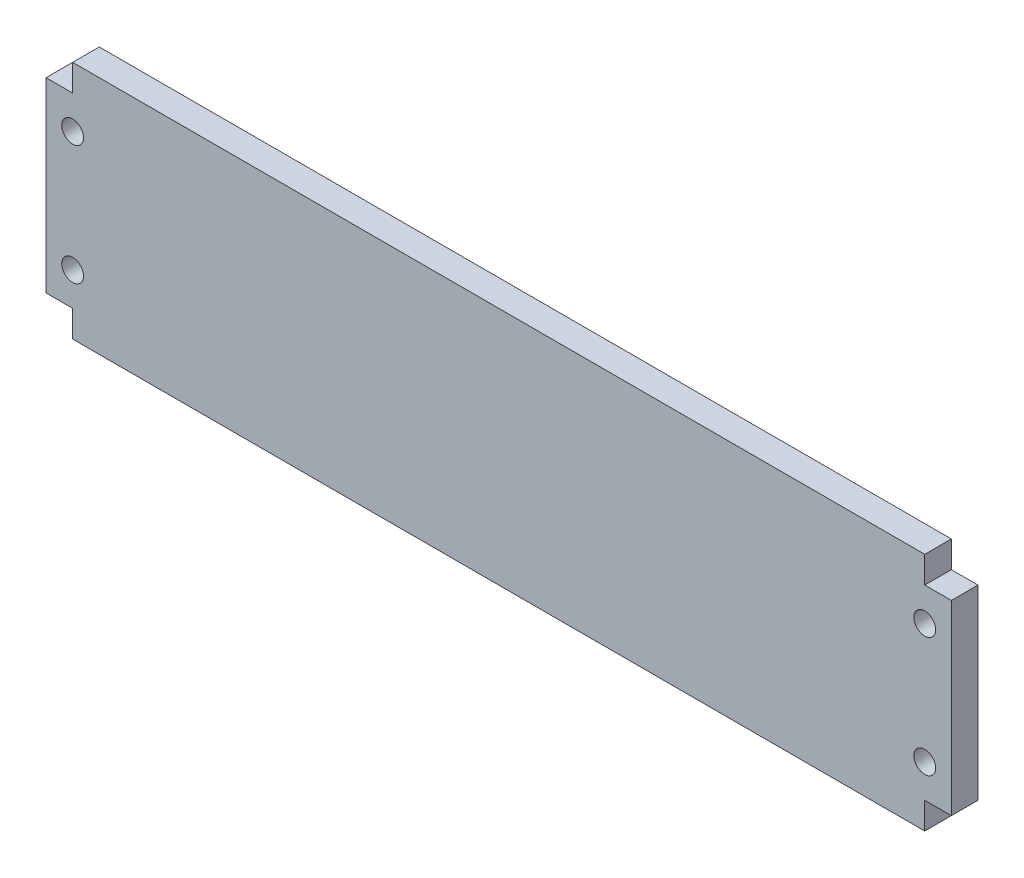
from build123d import *

# Parameters (mm, degrees)
CROQUIS1_W              = 170
CROQUIS1_H              = 45
SALIENTE_EXTRUIR1_DEPTH = 5
CROQUIS2_W              = 5
CROQUIS2_H              = 5
CORTAR_EXTRUIR1_DEPTH   = 10
SALIENTE_EXTRUIR4_DEPTH = 2
CROQUIS5_R              = 2.05
CORTAR_EXTRUIR2_DEPTH   = 10


with BuildPart() as part:
    # Croquis1 → Saliente-Extruir1 (new body)
    with BuildSketch(Plane.XY):
        Rectangle(CROQUIS1_W, CROQUIS1_H)
    extrude(amount=SALIENTE_EXTRUIR1_DEPTH)

    # Croquis2 → Cortar-Extruir1 (cut)
    with BuildSketch(Plane.XY.offset(5)):
        with Locations((-82.5, 20)):
            Rectangle(CROQUIS2_W, CROQUIS2_H)
        with Locations((-82.5, -20)):
            Rectangle(CROQUIS2_W, CROQUIS2_H)
        with Locations((82.5, -20)):
            Rectangle(CROQUIS2_W, CROQUIS2_H)
        with Locations((82.5, 20)):
            Rectangle(CROQUIS2_W, CROQUIS2_H)
    extrude(amount=-CORTAR_EXTRUIR1_DEPTH, mode=Mode.SUBTRACT)

    # Croquis4 → Saliente-Extruir4 (add)
    # profile 1 of 19: a face of its own
    with BuildSketch(Plane(origin=(0, 0, 0), x_dir=(-1, 0, 0), z_dir=(0, 0, -1))):
        with BuildLine():
            Line((-29.047398361, -7.761025019), (-28.20022288, -7.761025019))
            add(Edge.make_bspline(
                [(-28.20022288, -7.761025019), (-28.143688373, -7.761213204), (-28.035135855, -7.76157454), (-27.879623423, -7.763589319), (-27.738318268, -7.769364016), (-27.611294272, -7.774333446), (-27.498553765, -7.783395127), (-27.399751042, -7.7920561), (-27.31534116, -7.803393766), (-27.264243797, -7.813923183), (-27.241108297, -7.818690617)],
                knots=[0, 0, 0, 0, 1.410062039, 2.707475311, 3.878576406, 4.937260626, 5.877586885, 6.699081471, 7.410979367, 8, 8, 8, 8], degree=3))
            add(Edge.make_bspline(
                [(-27.241108297, -7.818690617), (-27.210136475, -7.82634299), (-27.148853545, -7.841484491), (-27.060618704, -7.873488008), (-26.976539474, -7.910523173), (-26.896965115, -7.954022149), (-26.822294205, -8.004307835), (-26.75175682, -8.060512136), (-26.685032878, -8.122327518), (-26.624820811, -8.191312517), (-26.568046911, -8.2636862), (-26.520163525, -8.341946934), (-26.478886735, -8.423785163), (-26.446023348, -8.510033182), (-26.419561418, -8.599854564), (-26.400903014, -8.694062918), (-26.389713482, -8.792229049), (-26.388574285, -8.859185758), (-26.387996652, -8.893136397)],
                knots=[0, 0, 0, 0, 1.027469482, 2.033020251, 3.019912614, 3.986113645, 4.951240523, 5.91722682, 6.890402269, 7.87763091, 8.8651537, 9.85103654, 10.82876324, 11.815024772, 12.821070561, 13.842952187, 14.906261191, 16, 16, 16, 16], degree=3))
            add(Edge.make_bspline(
                [(-26.387996652, -8.893136397), (-26.38977344, -8.949542666), (-26.393240414, -9.059605907), (-26.425565063, -9.219336688), (-26.478513806, -9.368337097), (-26.55147626, -9.506419526), (-26.644391245, -9.630892401), (-26.756060278, -9.740221809), (-26.886545656, -9.831710084), (-27.008017305, -9.895153001), (-27.115319242, -9.935784423), (-27.203654772, -9.964373162), (-27.300013878, -9.986461444), (-27.403473321, -10.006249413), (-27.514463647, -10.021189081), (-27.632718838, -10.032131153), (-27.758323231, -10.038969859), (-27.844609534, -10.039988284), (-27.888998254, -10.040512198)],
                knots=[0, 0, 0, 0, 1.260483769, 2.459530307, 3.627416485, 4.787058657, 5.939039949, 7.08810263, 8.267026773, 9.491475466, 10.141966685, 10.831826277, 11.566392101, 12.351337768, 13.187381173, 14.07005841, 15.007169909, 16, 16, 16, 16], degree=3))
            Line((-27.888998254, -10.040512198), (-26.333723147, -11.994358352))
            Line((-26.333723147, -11.994358352), (-26.803528169, -11.994358352))
            Line((-26.803528169, -11.994358352), (-28.358803276, -10.040512198))
            Line((-28.358803276, -10.040512198), (-28.667483831, -10.040512198))
            Line((-28.667483831, -10.040512198), (-28.667483831, -11.994358352))
            Line((-28.667483831, -11.994358352), (-29.047398361, -11.994358352))
            Line((-29.047398361, -11.994358352), (-29.047398361, -7.761025019))
        make_face()
        with BuildLine():
            Line((-28.667483831, -8.195213053), (-28.667483831, -9.606324164))
            Line((-28.667483831, -9.606324164), (-27.892390348, -9.612260328))
            add(Edge.make_bspline(
                [(-27.892390348, -9.612260328), (-27.856201349, -9.612276338), (-27.786056761, -9.612307371), (-27.684576909, -9.607476803), (-27.590088774, -9.601981551), (-27.502953769, -9.593576153), (-27.423132968, -9.582743571), (-27.350666268, -9.569193294), (-27.285435377, -9.553406514), (-27.209358097, -9.528972166), (-27.12440534, -9.490260125), (-27.032080622, -9.433938046), (-26.953458747, -9.363097302), (-26.887034285, -9.282091312), (-26.833658687, -9.193026516), (-26.796027916, -9.096970527), (-26.772148962, -8.996348308), (-26.769332531, -8.927190025), (-26.767911182, -8.892288373)],
                knots=[0, 0, 0, 0, 1.146690395, 2.22261258, 3.21895312, 4.145990853, 4.996080663, 5.770904154, 6.481378293, 7.121626537, 8.300444488, 9.431385265, 10.535395872, 11.636531494, 12.74115979, 13.810798291, 14.895190096, 16, 16, 16, 16], degree=3))
            add(Edge.make_bspline(
                [(-26.767911182, -8.892288373), (-26.769365176, -8.858244422), (-26.772246461, -8.790781734), (-26.79577021, -8.692016966), (-26.8355507, -8.598802655), (-26.889159502, -8.511517992), (-26.954472766, -8.432287245), (-27.031057168, -8.364496879), (-27.116818689, -8.30855705), (-27.196975282, -8.272810323), (-27.268620472, -8.250893929), (-27.33082587, -8.235471093), (-27.401113086, -8.223080164), (-27.479823403, -8.213152319), (-27.566620804, -8.204619196), (-27.661944163, -8.198871806), (-27.76516103, -8.195468371), (-27.836700652, -8.195300139), (-27.873733831, -8.195213053)],
                knots=[0, 0, 0, 0, 1.101028733, 2.181837193, 3.264309656, 4.369019818, 5.486613113, 6.575447106, 7.666700264, 8.788928104, 9.402425223, 10.0903467, 10.862060571, 11.710948788, 12.657782767, 13.684531032, 14.801375019, 16, 16, 16, 16], degree=3))
            Line((-27.873733831, -8.195213053), (-28.667483831, -8.195213053))
        make_face(mode=Mode.SUBTRACT)
    # profile 2 of 19: a face of its own
    with BuildSketch(Plane(origin=(0, 0, 0), x_dir=(-1, 0, 0), z_dir=(0, 0, -1))):
        with BuildLine():
            add(Edge.make_bspline(
                [(-24.079676673, -8.846495104), (-24.021630086, -8.847731106), (-23.907814914, -8.850154603), (-23.741132995, -8.876056514), (-23.582026021, -8.915665231), (-23.429884627, -8.970422263), (-23.286657298, -9.043818527), (-23.150257793, -9.131399289), (-23.021060078, -9.235155378), (-22.9436227, -9.315417042), (-22.904316096, -9.35615723)],
                knots=[0, 0, 0, 0, 1.054011418, 2.066658804, 3.057071809, 4.030435133, 4.997543892, 5.974964718, 6.972108034, 8, 8, 8, 8], degree=3))
            add(Edge.make_bspline(
                [(-22.904316096, -9.35615723), (-22.870471256, -9.395120813), (-22.803436568, -9.472293926), (-22.717480889, -9.597425953), (-22.643431954, -9.727014456), (-22.584089135, -9.86278027), (-22.537298678, -10.003538205), (-22.504078264, -10.149772067), (-22.484318352, -10.301158905), (-22.481653811, -10.403973072), (-22.480304344, -10.456043715)],
                knots=[0, 0, 0, 0, 1.025258237, 2.030674902, 3.01204498, 3.988269485, 4.97094183, 5.956517959, 6.965070386, 8, 8, 8, 8], degree=3))
            add(Edge.make_bspline(
                [(-22.480304344, -10.456043715), (-22.481491295, -10.508416166), (-22.483836765, -10.611906571), (-22.506023806, -10.764329994), (-22.540532834, -10.912127542), (-22.589919914, -11.054680438), (-22.653248294, -11.192424429), (-22.730525602, -11.324757884), (-22.822294129, -11.451941893), (-22.926318011, -11.572896497), (-23.041285518, -11.684373729), (-23.166006955, -11.781532683), (-23.298031357, -11.864773955), (-23.43911427, -11.93182562), (-23.587967326, -11.984693543), (-23.744911589, -12.021825944), (-23.909703246, -12.044276743), (-24.022221885, -12.047159731), (-24.079676673, -12.048631856)],
                knots=[0, 0, 0, 0, 0.998656419, 1.973391657, 2.932242238, 3.890759089, 4.846373663, 5.82037756, 6.809684879, 7.83454468, 8.860553229, 9.859544525, 10.845671541, 11.83227036, 12.833544569, 13.85385346, 14.904124723, 16, 16, 16, 16], degree=3))
            add(Edge.make_bspline(
                [(-24.079676673, -12.048631856), (-24.137412953, -12.04715479), (-24.250492374, -12.044261882), (-24.415865704, -12.021913169), (-24.573091243, -11.984710656), (-24.722139167, -11.93165188), (-24.863828649, -11.864771812), (-24.996618031, -11.78178434), (-25.121440786, -11.684344914), (-25.236432615, -11.572904305), (-25.340449975, -11.451939881), (-25.432220185, -11.324758406), (-25.509497056, -11.192424293), (-25.57282555, -11.054680474), (-25.6222126, -10.912127532), (-25.656721636, -10.764329997), (-25.678908675, -10.61190657), (-25.681254145, -10.508416166), (-25.682441096, -10.456043715)],
                knots=[0, 0, 0, 0, 1.099876186, 2.154163076, 3.173186993, 4.173200201, 5.163417411, 6.152872554, 7.150605724, 8.17532212, 9.198891216, 10.186952605, 11.159729845, 12.11414092, 13.071450619, 14.029093627, 15.002601286, 16, 16, 16, 16], degree=3))
            add(Edge.make_bspline(
                [(-25.682441096, -10.456043715), (-25.681082426, -10.404256083), (-25.678392491, -10.301725473), (-25.658652447, -10.150623219), (-25.625561621, -10.004636853), (-25.578715075, -9.864422229), (-25.518825273, -9.729251369), (-25.445816858, -9.599342668), (-25.358984379, -9.474776472), (-25.292216304, -9.397703099), (-25.258429344, -9.358701301)],
                knots=[0, 0, 0, 0, 1.031353054, 2.041901799, 3.029428768, 4.008703097, 4.981709435, 5.96992636, 6.972712378, 8, 8, 8, 8], degree=3))
            add(Edge.make_bspline(
                [(-25.258429344, -9.358701301), (-25.219182001, -9.317607803), (-25.141995194, -9.236790208), (-25.012154352, -9.133336584), (-24.876090397, -9.043933333), (-24.731280248, -8.971995434), (-24.579263839, -8.915343132), (-24.419341517, -8.875954366), (-24.252093989, -8.850247927), (-24.137721876, -8.847758512), (-24.079676673, -8.846495104)],
                knots=[0, 0, 0, 0, 1.027980169, 2.021703884, 2.998553061, 3.971491411, 4.943284454, 5.930300938, 6.949603206, 8, 8, 8, 8], degree=3))
        make_face()
        with BuildLine():
            add(Edge.make_bspline(
                [(-24.08137272, -9.226409634), (-24.122421069, -9.227576331), (-24.20345811, -9.229879606), (-24.322740846, -9.247398233), (-24.437573223, -9.275153786), (-24.548173101, -9.314589168), (-24.65416751, -9.365508789), (-24.75565793, -9.428051282), (-24.852942881, -9.501388286), (-24.944119281, -9.585405041), (-25.027796935, -9.677182492), (-25.100946488, -9.774970507), (-25.163146378, -9.877182945), (-25.21496257, -9.983926095), (-25.253555074, -10.096281682), (-25.281583396, -10.212977302), (-25.299085497, -10.334250711), (-25.301367117, -10.416693085), (-25.302526566, -10.458587786)],
                knots=[0, 0, 0, 0, 1.021534396, 2.016698045, 2.994645724, 3.958388632, 4.93408049, 5.916473867, 6.921342795, 7.962252576, 8.998418191, 10.008913653, 10.997312074, 11.973003931, 12.956656626, 13.948281152, 14.957379055, 16, 16, 16, 16], degree=3))
            add(Edge.make_bspline(
                [(-25.302526566, -10.458587786), (-25.300583075, -10.512716428), (-25.296725608, -10.620151661), (-25.265356322, -10.778370829), (-25.212879583, -10.930265069), (-25.142016873, -11.074943936), (-25.053230304, -11.208804691), (-24.948622138, -11.328150201), (-24.829315072, -11.431184468), (-24.696731305, -11.516674634), (-24.553578939, -11.584601195), (-24.402078437, -11.632739004), (-24.244065407, -11.664031432), (-24.136078237, -11.667141691), (-24.08137272, -11.668717326)],
                knots=[0, 0, 0, 0, 1.016792936, 2.018143844, 3.017858371, 4.030088057, 5.03801393, 6.028138512, 7.003788237, 7.991172063, 8.984598303, 9.972568034, 10.972917682, 12, 12, 12, 12], degree=3))
            add(Edge.make_bspline(
                [(-24.08137272, -11.668717326), (-24.02667035, -11.667132511), (-23.918689391, -11.66400413), (-23.760895911, -11.632896605), (-23.609809487, -11.584390273), (-23.466805809, -11.516751028), (-23.334282394, -11.430859822), (-23.214117266, -11.328732013), (-23.110402279, -11.208488593), (-23.021703538, -11.07476663), (-22.949680335, -10.930489366), (-22.897449224, -10.778342795), (-22.866004525, -10.620158801), (-22.862157237, -10.51271882), (-22.860218874, -10.458587786)],
                knots=[0, 0, 0, 0, 1.02726834, 2.027799167, 3.010890988, 4.004497153, 4.992059811, 5.971914811, 6.958719428, 7.966827853, 8.981595046, 9.981490638, 10.983022906, 12, 12, 12, 12], degree=3))
            add(Edge.make_bspline(
                [(-22.860218874, -10.458587786), (-22.861377924, -10.416692835), (-22.863658759, -10.334249968), (-22.881166573, -10.212980143), (-22.909173749, -10.096271259), (-22.947844182, -9.983964551), (-22.999435227, -9.876906569), (-23.062834586, -9.775270614), (-23.135685445, -9.676843744), (-23.22037282, -9.585701721), (-23.311454049, -9.501355534), (-23.408778428, -9.428022844), (-23.510118355, -9.365783657), (-23.615804831, -9.314153633), (-23.726418889, -9.275512564), (-23.841090369, -9.247237971), (-23.959864168, -9.229953638), (-24.04061082, -9.227598524), (-24.08137272, -9.226409634)],
                knots=[0, 0, 0, 0, 1.042956736, 2.052379634, 3.044323526, 4.02829302, 5.004299113, 5.996692471, 7.007513377, 8.048758398, 9.090003419, 10.095195979, 11.07790575, 12.047570684, 13.018257071, 13.989683339, 14.985167495, 16, 16, 16, 16], degree=3))
        make_face(mode=Mode.SUBTRACT)
    # profile 3 of 19: a face of its own
    with BuildSketch(Plane(origin=(0, 0, 0), x_dir=(-1, 0, 0), z_dir=(0, 0, -1))):
        with BuildLine():
            Line((-21.720475284, -11.994358352), (-21.720475284, -7.65247801))
            Line((-21.720475284, -7.65247801), (-21.340560754, -7.65247801))
            Line((-21.340560754, -7.65247801), (-21.340560754, -9.462160168))
            add(Edge.make_bspline(
                [(-21.340560754, -9.462160168), (-21.297751571, -9.412862479), (-21.214229091, -9.316680656), (-21.074194716, -9.191074451), (-20.927351789, -9.084572883), (-20.772583232, -8.996778244), (-20.609668923, -8.929923501), (-20.439450086, -8.881031658), (-20.26149159, -8.851535118), (-20.14015316, -8.848189486), (-20.07870178, -8.846495104)],
                knots=[0, 0, 0, 0, 1.077089805, 2.101446609, 3.097517232, 4.067117542, 5.031729543, 5.997785507, 6.985986182, 8, 8, 8, 8], degree=3))
            add(Edge.make_bspline(
                [(-20.07870178, -8.846495104), (-20.024072261, -8.84799519), (-19.916060391, -8.850961114), (-19.757271509, -8.87349998), (-19.604492595, -8.910049131), (-19.457806811, -8.960718719), (-19.317898613, -9.027947654), (-19.183570039, -9.10843095), (-19.055509306, -9.204271596), (-18.935700063, -9.31385241), (-18.825277934, -9.432817087), (-18.72862185, -9.560035182), (-18.646979361, -9.693657434), (-18.579450083, -9.833236558), (-18.527233667, -9.97934262), (-18.491259686, -10.131832365), (-18.468407591, -10.290555778), (-18.465528627, -10.398581741), (-18.464065028, -10.453499645)],
                knots=[0, 0, 0, 0, 1.034377878, 2.045141349, 3.03070803, 4.00595497, 4.978199603, 5.965204761, 6.967410914, 8.002051993, 9.036360596, 10.037508045, 11.022711142, 11.997267194, 12.969246472, 13.954813154, 14.960274251, 16, 16, 16, 16], degree=3))
            add(Edge.make_bspline(
                [(-18.464065028, -10.453499645), (-18.465560532, -10.50756538), (-18.468509431, -10.614174497), (-18.491032346, -10.771057665), (-18.528220686, -10.922053044), (-18.581392784, -11.06677046), (-18.648237043, -11.205889783), (-18.731828776, -11.337825129), (-18.82836208, -11.464872271), (-18.940038803, -11.582950378), (-19.060886624, -11.692089824), (-19.190201946, -11.786923584), (-19.324727509, -11.868829053), (-19.466560035, -11.933726595), (-19.613599475, -11.986221042), (-19.767421134, -12.022649107), (-19.927154752, -12.043904135), (-20.035671884, -12.047043535), (-20.090574109, -12.048631856)],
                knots=[0, 0, 0, 0, 1.024244038, 2.01964794, 2.996620209, 3.965911562, 4.936179293, 5.91563013, 6.920572822, 7.955171681, 8.990768464, 10.002129126, 10.989675881, 11.969873457, 12.952483066, 13.943799762, 14.959703725, 16, 16, 16, 16], degree=3))
            add(Edge.make_bspline(
                [(-20.090574109, -12.048631856), (-20.15342715, -12.046889406), (-20.276671003, -12.043472766), (-20.45695375, -12.015146953), (-20.627595244, -11.966933386), (-20.790539326, -11.902149167), (-20.943456667, -11.814424033), (-21.087318133, -11.705619202), (-21.221216498, -11.573941808), (-21.300097789, -11.473476959), (-21.340560754, -11.421942487)],
                knots=[0, 0, 0, 0, 1.035807596, 2.031038093, 2.998900396, 3.954262848, 4.914341711, 5.895762244, 6.92060972, 8, 8, 8, 8], degree=3))
            Line((-21.340560754, -11.421942487), (-21.340560754, -11.994358352))
            Line((-21.340560754, -11.994358352), (-21.720475284, -11.994358352))
        make_face()
        with BuildLine():
            add(Edge.make_bspline(
                [(-20.093966203, -11.668717326), (-20.0384317, -11.666741413), (-19.928815426, -11.662841275), (-19.767895793, -11.632393179), (-19.613906226, -11.581733346), (-19.467622688, -11.512447337), (-19.331334377, -11.425334971), (-19.20959262, -11.319929603), (-19.101364781, -11.199580152), (-19.01107168, -11.063830827), (-18.935686604, -10.919352036), (-18.883902927, -10.767370167), (-18.84916574, -10.61195266), (-18.845715817, -10.506547444), (-18.843979558, -10.453499645)],
                knots=[0, 0, 0, 0, 1.031910345, 2.036826888, 3.032245421, 4.038315463, 5.03827337, 6.029480047, 7.023177075, 8.037597977, 9.052889626, 10.043399556, 11.015292101, 12, 12, 12, 12], degree=3))
            add(Edge.make_bspline(
                [(-18.843979558, -10.453499645), (-18.846262829, -10.400503703), (-18.850820256, -10.294723395), (-18.882721183, -10.137909035), (-18.938429177, -9.986007813), (-19.012352881, -9.839440151), (-19.104117016, -9.702754525), (-19.211771848, -9.5799998), (-19.335000318, -9.474093915), (-19.47146293, -9.385810686), (-19.616823732, -9.313771988), (-19.769817165, -9.264368957), (-19.927246514, -9.232028483), (-20.034162967, -9.228292109), (-20.088030038, -9.226409634)],
                knots=[0, 0, 0, 0, 0.984795267, 1.965658976, 2.959410029, 3.983795688, 5.009594896, 6.01088574, 7.009236619, 8.019050059, 9.024672985, 10.014834719, 10.999826153, 12, 12, 12, 12], degree=3))
            add(Edge.make_bspline(
                [(-20.088030038, -9.226409634), (-20.143024071, -9.228291045), (-20.252176068, -9.232025265), (-20.413246203, -9.264425776), (-20.570560842, -9.314073839), (-20.720889571, -9.385352709), (-20.861017809, -9.472573238), (-20.986339731, -9.575068526), (-21.094388376, -9.69212613), (-21.183341318, -9.82336648), (-21.253983313, -9.965104571), (-21.304521751, -10.116309807), (-21.334759419, -10.276186252), (-21.338603446, -10.385809272), (-21.340560754, -10.441627316)],
                knots=[0, 0, 0, 0, 1.016820015, 2.018181405, 3.029022337, 4.06341356, 5.088169224, 6.076823655, 7.05054209, 8.02560866, 9.001194327, 9.972267242, 10.967515442, 12, 12, 12, 12], degree=3))
            add(Edge.make_bspline(
                [(-21.340560754, -10.441627316), (-21.33940001, -10.484369248), (-21.337115298, -10.568498898), (-21.319661424, -10.692024771), (-21.291896004, -10.810235274), (-21.252775778, -10.92325922), (-21.201369523, -11.030455009), (-21.139429487, -11.13265503), (-21.06570702, -11.228937091), (-20.982362859, -11.319065145), (-20.890484551, -11.401082246), (-20.791880398, -11.472175908), (-20.688565377, -11.533394977), (-20.579357507, -11.582193024), (-20.465527661, -11.622018435), (-20.345907762, -11.648305918), (-20.22172423, -11.666418584), (-20.137000598, -11.667943011), (-20.093966203, -11.668717326)],
                knots=[0, 0, 0, 0, 1.050331198, 2.067384183, 3.060053655, 4.031335885, 5.001026174, 5.976994447, 6.963687968, 7.976578778, 8.990422448, 9.985569286, 10.960374351, 11.936812464, 12.921228065, 13.919088064, 14.943024695, 16, 16, 16, 16], degree=3))
        make_face(mode=Mode.SUBTRACT)
    # profile 4 of 19: a face of its own
    with BuildSketch(Plane(origin=(0, 0, 0), x_dir=(-1, 0, 0), z_dir=(0, 0, -1))):
        with BuildLine():
            add(Edge.make_bspline(
                [(-16.210018553, -8.846495104), (-16.151971966, -8.847731106), (-16.038156795, -8.850154603), (-15.871474876, -8.876056514), (-15.712367902, -8.915665231), (-15.560226507, -8.970422263), (-15.416999179, -9.043818527), (-15.280599674, -9.131399289), (-15.151401958, -9.235155378), (-15.07396458, -9.315417042), (-15.034657977, -9.35615723)],
                knots=[0, 0, 0, 0, 1.054011418, 2.066658804, 3.057071809, 4.030435133, 4.997543892, 5.974964718, 6.972108034, 8, 8, 8, 8], degree=3))
            add(Edge.make_bspline(
                [(-15.034657977, -9.35615723), (-15.000813137, -9.395120813), (-14.933778448, -9.472293926), (-14.847822769, -9.597425953), (-14.773773835, -9.727014456), (-14.714431015, -9.86278027), (-14.667640558, -10.003538205), (-14.634420145, -10.149772067), (-14.614660233, -10.301158905), (-14.611995692, -10.403973072), (-14.610646224, -10.456043715)],
                knots=[0, 0, 0, 0, 1.025258237, 2.030674902, 3.01204498, 3.988269485, 4.97094183, 5.956517959, 6.965070386, 8, 8, 8, 8], degree=3))
            add(Edge.make_bspline(
                [(-14.610646224, -10.456043715), (-14.611833175, -10.508416166), (-14.614178645, -10.611906571), (-14.636365686, -10.764329994), (-14.670874714, -10.912127542), (-14.720261794, -11.054680438), (-14.783590174, -11.192424429), (-14.860867482, -11.324757884), (-14.952636009, -11.451941893), (-15.056659891, -11.572896497), (-15.171627398, -11.684373729), (-15.296348835, -11.781532683), (-15.428373238, -11.864773955), (-15.569456151, -11.93182562), (-15.718309206, -11.984693543), (-15.87525347, -12.021825944), (-16.040045126, -12.044276743), (-16.152563765, -12.047159731), (-16.210018553, -12.048631856)],
                knots=[0, 0, 0, 0, 0.998656419, 1.973391657, 2.932242238, 3.890759089, 4.846373663, 5.82037756, 6.809684879, 7.83454468, 8.860553229, 9.859544525, 10.845671541, 11.83227036, 12.833544569, 13.85385346, 14.904124723, 16, 16, 16, 16], degree=3))
            add(Edge.make_bspline(
                [(-16.210018553, -12.048631856), (-16.267754833, -12.04715479), (-16.380834254, -12.044261882), (-16.546207585, -12.021913169), (-16.703433124, -11.984710656), (-16.852481048, -11.93165188), (-16.994170529, -11.864771812), (-17.126959911, -11.78178434), (-17.251782666, -11.684344914), (-17.366774495, -11.572904305), (-17.470791856, -11.451939881), (-17.562562066, -11.324758406), (-17.639838936, -11.192424293), (-17.703167431, -11.054680474), (-17.752554481, -10.912127532), (-17.787063516, -10.764329997), (-17.809250555, -10.61190657), (-17.811596026, -10.508416166), (-17.812782977, -10.456043715)],
                knots=[0, 0, 0, 0, 1.099876186, 2.154163076, 3.173186993, 4.173200201, 5.163417411, 6.152872554, 7.150605724, 8.17532212, 9.198891216, 10.186952605, 11.159729845, 12.11414092, 13.071450619, 14.029093627, 15.002601286, 16, 16, 16, 16], degree=3))
            add(Edge.make_bspline(
                [(-17.812782977, -10.456043715), (-17.811424306, -10.404256083), (-17.808734372, -10.301725473), (-17.788994327, -10.150623219), (-17.755903502, -10.004636853), (-17.709056956, -9.864422229), (-17.649167153, -9.729251369), (-17.576158738, -9.599342668), (-17.489326259, -9.474776472), (-17.422558184, -9.397703099), (-17.388771224, -9.358701301)],
                knots=[0, 0, 0, 0, 1.031353054, 2.041901799, 3.029428768, 4.008703097, 4.981709435, 5.96992636, 6.972712378, 8, 8, 8, 8], degree=3))
            add(Edge.make_bspline(
                [(-17.388771224, -9.358701301), (-17.349523881, -9.317607803), (-17.272337074, -9.236790208), (-17.142496232, -9.133336584), (-17.006432277, -9.043933333), (-16.861622128, -8.971995434), (-16.709605719, -8.915343132), (-16.549683397, -8.875954366), (-16.382435869, -8.850247927), (-16.268063756, -8.847758512), (-16.210018553, -8.846495104)],
                knots=[0, 0, 0, 0, 1.027980169, 2.021703884, 2.998553061, 3.971491411, 4.943284454, 5.930300938, 6.949603206, 8, 8, 8, 8], degree=3))
        make_face()
        with BuildLine():
            add(Edge.make_bspline(
                [(-16.2117146, -9.226409634), (-16.252762949, -9.227576331), (-16.333799991, -9.229879606), (-16.453082727, -9.247398233), (-16.567915103, -9.275153786), (-16.678514981, -9.314589168), (-16.78450939, -9.365508789), (-16.88599981, -9.428051282), (-16.983284761, -9.501388286), (-17.074461161, -9.585405041), (-17.158138815, -9.677182492), (-17.231288368, -9.774970507), (-17.293488258, -9.877182945), (-17.345304451, -9.983926095), (-17.383896954, -10.096281682), (-17.411925277, -10.212977302), (-17.429427377, -10.334250711), (-17.431708997, -10.416693085), (-17.432868447, -10.458587786)],
                knots=[0, 0, 0, 0, 1.021534396, 2.016698045, 2.994645724, 3.958388632, 4.93408049, 5.916473867, 6.921342795, 7.962252576, 8.998418191, 10.008913653, 10.997312074, 11.973003931, 12.956656626, 13.948281152, 14.957379055, 16, 16, 16, 16], degree=3))
            add(Edge.make_bspline(
                [(-17.432868447, -10.458587786), (-17.430924955, -10.512716428), (-17.427067488, -10.620151661), (-17.395698202, -10.778370829), (-17.343221464, -10.930265069), (-17.272358754, -11.074943936), (-17.183572185, -11.208804691), (-17.078964018, -11.328150201), (-16.959656952, -11.431184468), (-16.827073185, -11.516674634), (-16.68392082, -11.584601195), (-16.532420317, -11.632739004), (-16.374407287, -11.664031432), (-16.266420117, -11.667141691), (-16.2117146, -11.668717326)],
                knots=[0, 0, 0, 0, 1.016792936, 2.018143844, 3.017858371, 4.030088057, 5.03801393, 6.028138512, 7.003788237, 7.991172063, 8.984598303, 9.972568034, 10.972917682, 12, 12, 12, 12], degree=3))
            add(Edge.make_bspline(
                [(-16.2117146, -11.668717326), (-16.15701223, -11.667132511), (-16.049031271, -11.66400413), (-15.891237791, -11.632896605), (-15.740151368, -11.584390273), (-15.59714769, -11.516751028), (-15.464624274, -11.430859822), (-15.344459146, -11.328732013), (-15.240744159, -11.208488593), (-15.152045418, -11.07476663), (-15.080022215, -10.930489366), (-15.027791104, -10.778342795), (-14.996346405, -10.620158801), (-14.992499117, -10.51271882), (-14.990560754, -10.458587786)],
                knots=[0, 0, 0, 0, 1.02726834, 2.027799167, 3.010890988, 4.004497153, 4.992059811, 5.971914811, 6.958719428, 7.966827853, 8.981595046, 9.981490638, 10.983022906, 12, 12, 12, 12], degree=3))
            add(Edge.make_bspline(
                [(-14.990560754, -10.458587786), (-14.991719805, -10.416692835), (-14.994000639, -10.334249968), (-15.011508453, -10.212980143), (-15.03951563, -10.096271259), (-15.078186062, -9.983964551), (-15.129777107, -9.876906569), (-15.193176466, -9.775270614), (-15.266027326, -9.676843744), (-15.350714701, -9.585701721), (-15.441795929, -9.501355534), (-15.539120309, -9.428022844), (-15.640460235, -9.365783657), (-15.746146711, -9.314153633), (-15.856760769, -9.275512564), (-15.971432249, -9.247237971), (-16.090206048, -9.229953638), (-16.1709527, -9.227598524), (-16.2117146, -9.226409634)],
                knots=[0, 0, 0, 0, 1.042956736, 2.052379634, 3.044323526, 4.02829302, 5.004299113, 5.996692471, 7.007513377, 8.048758398, 9.090003419, 10.095195979, 11.07790575, 12.047570684, 13.018257071, 13.989683339, 14.985167495, 16, 16, 16, 16], degree=3))
        make_face(mode=Mode.SUBTRACT)
    # profile 5 of 19: a face of its own
    with BuildSketch(Plane(origin=(0, 0, 0), x_dir=(-1, 0, 0), z_dir=(0, 0, -1))):
        Polygon((-13.470902635, -7.65247801), (-13.090988105, -7.65247801), (-13.090988105, -8.900768608), (-12.548253062, -8.900768608), (-12.548253062, -9.280683138), (-13.090988105, -9.280683138), (-13.090988105, -11.994358352), (-13.470902635, -11.994358352), (-13.470902635, -9.280683138), (-14.013637677, -9.280683138), (-14.013637677, -8.900768608), (-13.470902635, -8.900768608), align=None)
    # profile 6 of 19: a face of its own
    with BuildSketch(Plane(origin=(0, 0, 0), x_dir=(-1, 0, 0), z_dir=(0, 0, -1))):
        with BuildLine():
            Line((-10.160218874, -7.761025019), (-9.313043393, -7.761025019))
            add(Edge.make_bspline(
                [(-9.313043393, -7.761025019), (-9.256508885, -7.761213204), (-9.147956368, -7.76157454), (-8.992443936, -7.763589319), (-8.851138781, -7.769364016), (-8.724114785, -7.774333446), (-8.611374278, -7.783395127), (-8.512571555, -7.7920561), (-8.428161673, -7.803393766), (-8.37706431, -7.813923183), (-8.35392881, -7.818690617)],
                knots=[0, 0, 0, 0, 1.410062039, 2.707475311, 3.878576406, 4.937260626, 5.877586885, 6.699081471, 7.410979367, 8, 8, 8, 8], degree=3))
            add(Edge.make_bspline(
                [(-8.35392881, -7.818690617), (-8.322956988, -7.82634299), (-8.261674058, -7.841484491), (-8.173439216, -7.873488008), (-8.089359986, -7.910523173), (-8.009785627, -7.954022149), (-7.935114718, -8.004307835), (-7.864577333, -8.060512136), (-7.797853391, -8.122327518), (-7.737641324, -8.191312517), (-7.680867424, -8.2636862), (-7.632984037, -8.341946934), (-7.591707248, -8.423785163), (-7.55884386, -8.510033182), (-7.532381931, -8.599854564), (-7.513723527, -8.694062918), (-7.502533995, -8.792229049), (-7.501394798, -8.859185758), (-7.500817165, -8.893136397)],
                knots=[0, 0, 0, 0, 1.027469482, 2.033020251, 3.019912614, 3.986113645, 4.951240523, 5.91722682, 6.890402269, 7.87763091, 8.8651537, 9.85103654, 10.82876324, 11.815024772, 12.821070561, 13.842952187, 14.906261191, 16, 16, 16, 16], degree=3))
            add(Edge.make_bspline(
                [(-7.500817165, -8.893136397), (-7.502593953, -8.949542666), (-7.506060927, -9.059605907), (-7.538385576, -9.219336688), (-7.591334319, -9.368337097), (-7.664296773, -9.506419526), (-7.757211758, -9.630892401), (-7.868880791, -9.740221809), (-7.999366169, -9.831710084), (-8.120837818, -9.895153001), (-8.228139754, -9.935784423), (-8.316475285, -9.964373162), (-8.412834391, -9.986461444), (-8.516293834, -10.006249413), (-8.62728416, -10.021189081), (-8.745539351, -10.032131153), (-8.871143744, -10.038969859), (-8.957430047, -10.039988284), (-9.001818767, -10.040512198)],
                knots=[0, 0, 0, 0, 1.260483769, 2.459530307, 3.627416485, 4.787058657, 5.939039949, 7.08810263, 8.267026773, 9.491475466, 10.141966685, 10.831826277, 11.566392101, 12.351337768, 13.187381173, 14.07005841, 15.007169909, 16, 16, 16, 16], degree=3))
            Line((-9.001818767, -10.040512198), (-7.44654366, -11.994358352))
            Line((-7.44654366, -11.994358352), (-7.916348682, -11.994358352))
            Line((-7.916348682, -11.994358352), (-9.471623788, -10.040512198))
            Line((-9.471623788, -10.040512198), (-9.780304344, -10.040512198))
            Line((-9.780304344, -10.040512198), (-9.780304344, -11.994358352))
            Line((-9.780304344, -11.994358352), (-10.160218874, -11.994358352))
            Line((-10.160218874, -11.994358352), (-10.160218874, -7.761025019))
        make_face()
        with BuildLine():
            Line((-9.780304344, -8.195213053), (-9.780304344, -9.606324164))
            Line((-9.780304344, -9.606324164), (-9.005210861, -9.612260328))
            add(Edge.make_bspline(
                [(-9.005210861, -9.612260328), (-8.969021862, -9.612276338), (-8.898877274, -9.612307371), (-8.797397422, -9.607476803), (-8.702909287, -9.601981551), (-8.615774282, -9.593576153), (-8.535953481, -9.582743571), (-8.463486781, -9.569193294), (-8.39825589, -9.553406514), (-8.32217861, -9.528972166), (-8.237225853, -9.490260125), (-8.144901135, -9.433938046), (-8.06627926, -9.363097302), (-7.999854798, -9.282091312), (-7.9464792, -9.193026516), (-7.908848429, -9.096970527), (-7.884969475, -8.996348308), (-7.882153044, -8.927190025), (-7.880731694, -8.892288373)],
                knots=[0, 0, 0, 0, 1.146690395, 2.22261258, 3.21895312, 4.145990853, 4.996080663, 5.770904154, 6.481378293, 7.121626537, 8.300444488, 9.431385265, 10.535395872, 11.636531494, 12.74115979, 13.810798291, 14.895190096, 16, 16, 16, 16], degree=3))
            add(Edge.make_bspline(
                [(-7.880731694, -8.892288373), (-7.882185689, -8.858244422), (-7.885066974, -8.790781734), (-7.908590723, -8.692016966), (-7.948371213, -8.598802655), (-8.001980015, -8.511517992), (-8.067293278, -8.432287245), (-8.14387768, -8.364496879), (-8.229639202, -8.30855705), (-8.309795794, -8.272810323), (-8.381440985, -8.250893929), (-8.443646383, -8.235471093), (-8.513933599, -8.223080164), (-8.592643916, -8.213152319), (-8.679441317, -8.204619196), (-8.774764676, -8.198871806), (-8.877981543, -8.195468371), (-8.949521165, -8.195300139), (-8.986554344, -8.195213053)],
                knots=[0, 0, 0, 0, 1.101028733, 2.181837193, 3.264309656, 4.369019818, 5.486613113, 6.575447106, 7.666700264, 8.788928104, 9.402425223, 10.0903467, 10.862060571, 11.710948788, 12.657782767, 13.684531032, 14.801375019, 16, 16, 16, 16], degree=3))
            Line((-8.986554344, -8.195213053), (-9.780304344, -8.195213053))
        make_face(mode=Mode.SUBTRACT)
    # profile 7 of 19: a face of its own
    with BuildSketch(Plane(origin=(0, 0, 0), x_dir=(-1, 0, 0), z_dir=(0, 0, -1))):
        with BuildLine():
            Line((-4.147732229, -11.017435275), (-3.810218874, -11.194672187))
            add(Edge.make_bspline(
                [(-3.810218874, -11.194672187), (-3.837114565, -11.242379836), (-3.88944293, -11.335200027), (-3.979432406, -11.462722372), (-4.073765675, -11.577442943), (-4.17670095, -11.676296906), (-4.285158562, -11.762477152), (-4.399739963, -11.837876235), (-4.521041676, -11.902124351), (-4.649069439, -11.956253599), (-4.78489842, -11.997872701), (-4.928857777, -12.027269235), (-5.0812233, -12.045440236), (-5.185661061, -12.047551025), (-5.239138479, -12.048631856)],
                knots=[0, 0, 0, 0, 1.120438281, 2.179929193, 3.190490725, 4.156257408, 5.095198341, 6.022838206, 6.959905092, 7.901321166, 8.864066838, 9.862729781, 10.905609505, 12, 12, 12, 12], degree=3))
            add(Edge.make_bspline(
                [(-5.239138479, -12.048631856), (-5.298576871, -12.04724432), (-5.414523954, -12.04453764), (-5.5833006, -12.021202945), (-5.742207135, -11.983136378), (-5.891234624, -11.929959008), (-6.03001811, -11.860499293), (-6.15883343, -11.775881634), (-6.278357999, -11.676540716), (-6.384825376, -11.561616065), (-6.480672739, -11.438629317), (-6.565249683, -11.310473152), (-6.635955338, -11.177470014), (-6.693471352, -11.040466618), (-6.73992295, -10.90032648), (-6.772297916, -10.755774515), (-6.790960564, -10.607201951), (-6.793820417, -10.506693745), (-6.795261609, -10.456043715)],
                knots=[0, 0, 0, 0, 1.145258523, 2.234067595, 3.276747158, 4.290159414, 5.277019952, 6.260822364, 7.254936242, 8.264827045, 9.274100331, 10.257902744, 11.220704747, 12.172965371, 13.118907548, 14.062713208, 15.023725156, 16, 16, 16, 16], degree=3))
            add(Edge.make_bspline(
                [(-6.795261609, -10.456043715), (-6.793980552, -10.408515682), (-6.791441667, -10.314321397), (-6.775438715, -10.174904977), (-6.747077446, -10.039403896), (-6.708159416, -9.907705564), (-6.657902195, -9.780030487), (-6.596419415, -9.656300963), (-6.523615301, -9.536648651), (-6.467405496, -9.461170575), (-6.439091737, -9.423151087)],
                knots=[0, 0, 0, 0, 1.024358464, 2.0301432, 3.019427413, 4.004406732, 4.986367066, 5.972626655, 6.978780325, 8, 8, 8, 8], degree=3))
            add(Edge.make_bspline(
                [(-6.439091737, -9.423151087), (-6.40074054, -9.377347787), (-6.325253014, -9.287192119), (-6.197580089, -9.168733382), (-6.05933128, -9.069499483), (-5.912239123, -8.987243233), (-5.754594054, -8.924742726), (-5.588515197, -8.878166889), (-5.412111488, -8.85206777), (-5.29151565, -8.848381343), (-5.22981022, -8.846495104)],
                knots=[0, 0, 0, 0, 1.030682036, 2.02871468, 2.997146059, 3.962720338, 4.930598197, 5.918074684, 6.934738563, 8, 8, 8, 8], degree=3))
            add(Edge.make_bspline(
                [(-5.22981022, -8.846495104), (-5.166373593, -8.848132858), (-5.041925391, -8.851345759), (-4.860457968, -8.881131896), (-4.688753101, -8.92836689), (-4.526879501, -8.995076713), (-4.374820755, -9.081145885), (-4.233565247, -9.187755541), (-4.100697227, -9.311632656), (-4.02339828, -9.406898633), (-3.984063692, -9.45537598)],
                knots=[0, 0, 0, 0, 1.056321875, 2.072262726, 3.055038591, 4.01806755, 4.982017516, 5.957941055, 6.960871419, 8, 8, 8, 8], degree=3))
            add(Edge.make_bspline(
                [(-3.984063692, -9.45537598), (-3.957300634, -9.491907931), (-3.903952659, -9.564728665), (-3.837129976, -9.683469017), (-3.779124365, -9.807699926), (-3.732759736, -9.939429524), (-3.69521672, -10.077097016), (-3.668054663, -10.22168657), (-3.652125696, -10.373155129), (-3.648994605, -10.47635963), (-3.647398361, -10.528973737)],
                knots=[0, 0, 0, 0, 0.94817472, 1.890038105, 2.849395472, 3.817997239, 4.812318967, 5.836947057, 6.897266129, 8, 8, 8, 8], degree=3))
            Line((-3.647398361, -10.528973737), (-6.415347079, -10.528973737))
            add(Edge.make_bspline(
                [(-6.415347079, -10.528973737), (-6.413484888, -10.56973525), (-6.409822966, -10.649891124), (-6.392750364, -10.767179595), (-6.365839942, -10.878907351), (-6.328019267, -10.984236364), (-6.282218416, -11.084542328), (-6.226113787, -11.179081172), (-6.159179279, -11.267422288), (-6.084520576, -11.350355873), (-6.001417708, -11.424210318), (-5.913990004, -11.490312942), (-5.820985406, -11.545715902), (-5.723137248, -11.590685864), (-5.620603756, -11.625890646), (-5.513352625, -11.649921248), (-5.401594903, -11.666016511), (-5.325412158, -11.667806201), (-5.286627795, -11.668717326)],
                knots=[0, 0, 0, 0, 1.094153842, 2.151609401, 3.174256925, 4.172055639, 5.149267565, 6.128595816, 7.11444997, 8.118368179, 9.117203808, 10.09244225, 11.054858984, 12.015122123, 12.976791628, 13.957293641, 14.960065497, 16, 16, 16, 16], degree=3))
            add(Edge.make_bspline(
                [(-5.286627795, -11.668717326), (-5.248707835, -11.667981867), (-5.173467362, -11.666522576), (-5.061416039, -11.65233255), (-4.951180611, -11.62938755), (-4.843217326, -11.59807299), (-4.73971735, -11.559880036), (-4.643867971, -11.513793722), (-4.555717615, -11.4628126), (-4.473328522, -11.40450185), (-4.393414082, -11.333130043), (-4.314138884, -11.244065886), (-4.229137599, -11.138731447), (-4.175931139, -11.059452404), (-4.147732229, -11.017435275)],
                knots=[0, 0, 0, 0, 0.99110716, 1.966546729, 2.947904876, 3.932708344, 4.903319531, 5.828989031, 6.710028674, 7.56322171, 8.463672341, 9.504779593, 10.677557249, 12, 12, 12, 12], degree=3))
        make_face()
        with BuildLine():
            add(Edge.make_bspline(
                [(-4.027312891, -10.149059207), (-4.041218332, -10.098666969), (-4.06798183, -10.001678133), (-4.123905814, -9.867371532), (-4.186887582, -9.748006166), (-4.261420533, -9.644495562), (-4.345867944, -9.552567503), (-4.443410213, -9.472232643), (-4.552794579, -9.400365822), (-4.673455635, -9.339705179), (-4.80123189, -9.288070779), (-4.935012712, -9.25344802), (-5.071516894, -9.229729811), (-5.163845031, -9.22752109), (-5.21030568, -9.226409634)],
                knots=[0, 0, 0, 0, 1.154881502, 2.222775134, 3.210006277, 4.132804581, 5.035138423, 5.962687519, 6.919655026, 7.923214229, 8.944639381, 9.960483929, 10.97369054, 12, 12, 12, 12], degree=3))
            add(Edge.make_bspline(
                [(-5.21030568, -9.226409634), (-5.248223572, -9.227149465), (-5.323179273, -9.228611956), (-5.433610089, -9.242485351), (-5.539660772, -9.265417735), (-5.642113834, -9.296822968), (-5.739626694, -9.338682897), (-5.834205128, -9.387769275), (-5.923444274, -9.447691001), (-5.97925327, -9.493361234), (-6.007447774, -9.516433672)],
                knots=[0, 0, 0, 0, 1.04873581, 2.073130211, 3.073294108, 4.04793562, 5.032784715, 6.005352987, 6.992311501, 8, 8, 8, 8], degree=3))
            add(Edge.make_bspline(
                [(-6.007447774, -9.516433672), (-6.027638696, -9.534690607), (-6.068500201, -9.571638192), (-6.123098736, -9.63529447), (-6.175374927, -9.703936836), (-6.222949917, -9.780191415), (-6.266586616, -9.863189881), (-6.307420113, -9.952232164), (-6.344173201, -10.04799395), (-6.364851354, -10.114726329), (-6.375489974, -10.149059207)],
                knots=[0, 0, 0, 0, 0.879870761, 1.780643979, 2.707998968, 3.669668524, 4.684282772, 5.740141944, 6.837334558, 8, 8, 8, 8], degree=3))
            Line((-6.375489974, -10.149059207), (-4.027312891, -10.149059207))
        make_face(mode=Mode.SUBTRACT)
    # profile 8 of 19: a face of its own
    with BuildSketch(Plane(origin=(0, 0, 0), x_dir=(-1, 0, 0), z_dir=(0, 0, -1))):
        with BuildLine():
            Line((-1.422184686, -9.286619303), (-1.679983831, -9.55205066))
            add(Edge.make_bspline(
                [(-1.679983831, -9.55205066), (-1.702227583, -9.526271902), (-1.745110918, -9.476573491), (-1.813124233, -9.410125801), (-1.880886116, -9.354322075), (-1.947468966, -9.30720839), (-2.014547063, -9.271588946), (-2.08133324, -9.245590399), (-2.147896648, -9.229501549), (-2.192390233, -9.227427894), (-2.214238639, -9.226409634)],
                knots=[0, 0, 0, 0, 1.26578478, 2.440284043, 3.530471711, 4.527705817, 5.468200915, 6.346673037, 7.188140097, 8, 8, 8, 8], degree=3))
            add(Edge.make_bspline(
                [(-2.214238639, -9.226409634), (-2.241016758, -9.227709718), (-2.293712307, -9.230268101), (-2.36921782, -9.255805297), (-2.439310481, -9.295004438), (-2.499976543, -9.350604534), (-2.551366403, -9.414424174), (-2.588878189, -9.485781634), (-2.611817998, -9.562523553), (-2.614726578, -9.615778714), (-2.61620178, -9.642789175)],
                knots=[0, 0, 0, 0, 0.99966794, 1.967205029, 2.953328237, 3.988086729, 5.028030931, 6.008226631, 6.989793394, 8, 8, 8, 8], degree=3))
            add(Edge.make_bspline(
                [(-2.61620178, -9.642789175), (-2.614858226, -9.667236123), (-2.612174906, -9.716061105), (-2.591314637, -9.78808587), (-2.558093768, -9.85830724), (-2.527045057, -9.901321422), (-2.511046865, -9.923484955)],
                knots=[0, 0, 0, 0, 0.960159726, 1.917612774, 2.927026955, 4, 4, 4, 4], degree=3))
            add(Edge.make_bspline(
                [(-2.511046865, -9.923484955), (-2.50141483, -9.935319642), (-2.480914257, -9.960508283), (-2.442441101, -9.995468182), (-2.398871026, -10.034103095), (-2.34647453, -10.07273146), (-2.287509001, -10.113409833), (-2.220695771, -10.154536222), (-2.148155179, -10.199245574), (-2.096221485, -10.227602177), (-2.06922662, -10.242341792)],
                knots=[0, 0, 0, 0, 0.66740084, 1.420478572, 2.27185888, 3.217733974, 4.268547843, 5.408967954, 6.65319498, 8, 8, 8, 8], degree=3))
            add(Edge.make_bspline(
                [(-2.06922662, -10.242341792), (-2.03631115, -10.260780865), (-1.972729302, -10.296399082), (-1.882386621, -10.351686057), (-1.800396581, -10.406636446), (-1.726064488, -10.460662578), (-1.660820586, -10.515276046), (-1.602685365, -10.568383524), (-1.553108866, -10.621589639), (-1.525345545, -10.658762072), (-1.512075177, -10.676529826)],
                knots=[0, 0, 0, 0, 1.27191281, 2.456916733, 3.569705269, 4.599008579, 5.553216877, 6.436649441, 7.252746552, 8, 8, 8, 8], degree=3))
            add(Edge.make_bspline(
                [(-1.512075177, -10.676529826), (-1.490049111, -10.712411666), (-1.446213151, -10.783823187), (-1.400180771, -10.90141119), (-1.373498344, -11.026125797), (-1.369794515, -11.111436197), (-1.367911182, -11.154815083)],
                knots=[0, 0, 0, 0, 0.995354457, 1.980940102, 2.973342416, 4, 4, 4, 4], degree=3))
            add(Edge.make_bspline(
                [(-1.367911182, -11.154815083), (-1.368781475, -11.185378717), (-1.370496483, -11.245607696), (-1.38242005, -11.334307919), (-1.402927497, -11.419137336), (-1.430859942, -11.501016395), (-1.468578184, -11.578376255), (-1.512783615, -11.653168671), (-1.565851365, -11.723775749), (-1.626438077, -11.790104777), (-1.692775007, -11.850684681), (-1.763539575, -11.903932701), (-1.838818922, -11.948170233), (-1.918075149, -11.984776889), (-2.00148833, -12.01388802), (-2.089071509, -12.034041748), (-2.180546288, -12.04610404), (-2.242751866, -12.047778597), (-2.274448308, -12.048631856)],
                knots=[0, 0, 0, 0, 1.032770009, 2.035186124, 3.017557409, 3.978232242, 4.952395191, 5.920591857, 6.910227898, 7.931268572, 8.952309245, 9.941945286, 10.918353717, 11.897095711, 12.887975737, 13.898235213, 14.929059601, 16, 16, 16, 16], degree=3))
            add(Edge.make_bspline(
                [(-2.274448308, -12.048631856), (-2.317225748, -12.047431162), (-2.402186241, -12.045046456), (-2.52784333, -12.022662934), (-2.650635105, -11.98783422), (-2.769632339, -11.939796852), (-2.882173829, -11.87913837), (-2.98514171, -11.806491475), (-3.078893669, -11.724255955), (-3.132255771, -11.661224148), (-3.158936823, -11.629708245)],
                knots=[0, 0, 0, 0, 1.013940152, 2.01379169, 3.017749504, 4.037548394, 5.051665909, 6.043208538, 7.021604269, 8, 8, 8, 8], degree=3))
            Line((-3.158936823, -11.629708245), (-2.907073842, -11.343076301))
            add(Edge.make_bspline(
                [(-2.907073842, -11.343076301), (-2.883158638, -11.368905397), (-2.836795398, -11.418979005), (-2.762650117, -11.485653208), (-2.687200746, -11.541534745), (-2.611200696, -11.588274875), (-2.533524963, -11.624288934), (-2.454608839, -11.649590472), (-2.374612841, -11.665851542), (-2.32088321, -11.667760512), (-2.293952848, -11.668717326)],
                knots=[0, 0, 0, 0, 1.179806542, 2.287233372, 3.337373186, 4.324005949, 5.273901747, 6.200048787, 7.097828587, 8, 8, 8, 8], degree=3))
            add(Edge.make_bspline(
                [(-2.293952848, -11.668717326), (-2.257282595, -11.667059281), (-2.185635071, -11.663819739), (-2.083014525, -11.634407637), (-1.988262091, -11.588288552), (-1.905986235, -11.522871822), (-1.835952193, -11.446725558), (-1.785239068, -11.360953242), (-1.753457408, -11.268072147), (-1.749724819, -11.20368641), (-1.747825712, -11.170927529)],
                knots=[0, 0, 0, 0, 1.072336372, 2.095165389, 3.102688358, 4.141489647, 5.156069229, 6.117746104, 7.042326257, 8, 8, 8, 8], degree=3))
            add(Edge.make_bspline(
                [(-1.747825712, -11.170927529), (-1.74913961, -11.143943514), (-1.751733728, -11.090667189), (-1.772106066, -11.013559634), (-1.804294945, -10.940420599), (-1.835990091, -10.897615978), (-1.852132603, -10.87581535)],
                knots=[0, 0, 0, 0, 1.013901739, 2.00181326, 2.98231254, 4, 4, 4, 4], degree=3))
            add(Edge.make_bspline(
                [(-1.852132603, -10.87581535), (-1.86183588, -10.864886864), (-1.882973122, -10.841080675), (-1.921744699, -10.806699866), (-1.968168475, -10.769642355), (-2.022766577, -10.730536529), (-2.085649069, -10.689898216), (-2.157070816, -10.647940618), (-2.236053389, -10.602670893), (-2.291897867, -10.572650929), (-2.3210896, -10.556958512)],
                knots=[0, 0, 0, 0, 0.615000592, 1.339693406, 2.178160186, 3.116406724, 4.166410947, 5.330106347, 6.604359322, 8, 8, 8, 8], degree=3))
            add(Edge.make_bspline(
                [(-2.3210896, -10.556958512), (-2.352593632, -10.539373086), (-2.413690003, -10.505269333), (-2.500228154, -10.452151789), (-2.578299716, -10.398125656), (-2.649783268, -10.346221556), (-2.712873247, -10.29370289), (-2.767321108, -10.240511357), (-2.815270521, -10.188792136), (-2.841816438, -10.152146834), (-2.854496385, -10.134642807)],
                knots=[0, 0, 0, 0, 1.262093308, 2.447601706, 3.550203992, 4.582594899, 5.537233252, 6.418365656, 7.244515135, 8, 8, 8, 8], degree=3))
            add(Edge.make_bspline(
                [(-2.854496385, -10.134642807), (-2.876425777, -10.099390492), (-2.920292224, -10.028873542), (-2.962885836, -9.911174203), (-2.992163604, -9.787264467), (-2.994779067, -9.701767034), (-2.99611631, -9.658053598)],
                knots=[0, 0, 0, 0, 0.985009483, 1.970363186, 2.962279964, 4, 4, 4, 4], degree=3))
            add(Edge.make_bspline(
                [(-2.99611631, -9.658053598), (-2.995470188, -9.629478116), (-2.994205636, -9.573551851), (-2.984113307, -9.49137823), (-2.96573857, -9.413305701), (-2.942691188, -9.338161781), (-2.910659363, -9.267402106), (-2.872382887, -9.200083069), (-2.827403812, -9.136297721), (-2.775583831, -9.077027266), (-2.718607222, -9.023192176), (-2.657048786, -8.976264311), (-2.59229299, -8.936221387), (-2.524065664, -8.902638764), (-2.451711378, -8.877237092), (-2.375735882, -8.859750541), (-2.296292961, -8.848072343), (-2.24198398, -8.847028422), (-2.214238639, -8.846495104)],
                knots=[0, 0, 0, 0, 1.087655834, 2.128696564, 3.144119009, 4.137814668, 5.115653402, 6.093965665, 7.082169637, 8.081268856, 9.086088321, 10.061021666, 11.022561449, 11.980240094, 12.950172527, 13.934149372, 14.944599409, 16, 16, 16, 16], degree=3))
            add(Edge.make_bspline(
                [(-2.214238639, -8.846495104), (-2.181349191, -8.84783083), (-2.114953322, -8.85052734), (-2.015343441, -8.871942794), (-1.915880256, -8.907179977), (-1.816308204, -8.95584666), (-1.717356711, -9.018822786), (-1.618155371, -9.094937272), (-1.517513277, -9.183689364), (-1.454670879, -9.251542713), (-1.422184686, -9.286619303)],
                knots=[0, 0, 0, 0, 0.845714091, 1.707292901, 2.609013841, 3.555613372, 4.552488639, 5.621697636, 6.770543573, 8, 8, 8, 8], degree=3))
        make_face()
    # profile 9 of 19: a face of its own
    with BuildSketch(Plane(origin=(0, 0, 0), x_dir=(-1, 0, 0), z_dir=(0, 0, -1))):
        with BuildLine():
            Line((2.431234118, -9.5715552), (2.113225303, -9.769144677))
            add(Edge.make_bspline(
                [(2.113225303, -9.769144677), (2.078354895, -9.725809381), (2.009718416, -9.64051121), (1.890532863, -9.530432529), (1.763519057, -9.43588763), (1.626506562, -9.358836427), (1.479687546, -9.299301911), (1.323641012, -9.257173948), (1.158389211, -9.230922149), (1.045098922, -9.227938452), (0.98705009, -9.226409634)],
                knots=[0, 0, 0, 0, 1.026593902, 2.0206758, 2.988051866, 3.946915611, 4.916868779, 5.907761954, 6.927957743, 8, 8, 8, 8], degree=3))
            add(Edge.make_bspline(
                [(0.98705009, -9.226409634), (0.940654018, -9.22768791), (0.849278216, -9.230205439), (0.715134583, -9.245941941), (0.587357642, -9.274537513), (0.465146499, -9.312215337), (0.349370373, -9.362713306), (0.239725929, -9.424168916), (0.135240622, -9.495591346), (0.038942278, -9.578335529), (-0.04914614, -9.668322489), (-0.125465779, -9.764786483), (-0.191913308, -9.864838161), (-0.244050988, -9.970975982), (-0.286717147, -10.08077178), (-0.314786228, -10.196298062), (-0.333491145, -10.316074795), (-0.33563119, -10.397739835), (-0.3367146, -10.439083245)],
                knots=[0, 0, 0, 0, 1.112346261, 2.190735716, 3.231507886, 4.247384806, 5.251966152, 6.253067467, 7.256802811, 8.280671706, 9.291813951, 10.270744147, 11.225547591, 12.165006084, 13.100104208, 14.043489273, 15.009504848, 16, 16, 16, 16], degree=3))
            add(Edge.make_bspline(
                [(-0.3367146, -10.439083245), (-0.334562553, -10.493232672), (-0.330287454, -10.600801909), (-0.296781879, -10.759585898), (-0.241936738, -10.913103124), (-0.16687629, -11.060263633), (-0.071956328, -11.196448944), (0.039528582, -11.318590837), (0.167640235, -11.424322604), (0.311249816, -11.511979849), (0.466985373, -11.58244836), (0.633161975, -11.632652467), (0.80842171, -11.662953908), (0.928414633, -11.666771097), (0.98959416, -11.668717326)],
                knots=[0, 0, 0, 0, 0.966302908, 1.919585723, 2.883856336, 3.870342332, 4.860282998, 5.839159637, 6.814385684, 7.815993281, 8.834850808, 9.858348828, 10.908058873, 12, 12, 12, 12], degree=3))
            add(Edge.make_bspline(
                [(0.98959416, -11.668717326), (1.045661859, -11.667145554), (1.155849767, -11.664056603), (1.316918769, -11.638016809), (1.47026209, -11.595388795), (1.615874279, -11.535943542), (1.753489261, -11.459105499), (1.882217882, -11.364328216), (2.004621617, -11.254338233), (2.076584626, -11.169286973), (2.113225303, -11.125982284)],
                knots=[0, 0, 0, 0, 1.039848629, 2.043578496, 3.018386758, 3.987534228, 4.954977003, 5.934852016, 6.948509513, 8, 8, 8, 8], degree=3))
            Line((2.113225303, -11.125982284), (2.431234118, -11.334596066))
            add(Edge.make_bspline(
                [(2.431234118, -11.334596066), (2.412380421, -11.362282945), (2.374735604, -11.417564807), (2.311806953, -11.495511501), (2.24392868, -11.568472012), (2.171365601, -11.636348541), (2.095065199, -11.700765383), (2.012420965, -11.758643002), (1.926097721, -11.813234644), (1.835082073, -11.86235688), (1.740315038, -11.906512145), (1.641929965, -11.944480514), (1.540354382, -11.977101499), (1.43546886, -12.00303048), (1.327066621, -12.023726447), (1.215428016, -12.037459019), (1.100591493, -12.047710073), (1.022973748, -12.048321931), (0.983657996, -12.048631856)],
                knots=[0, 0, 0, 0, 0.954134338, 1.905101784, 2.851144739, 3.791306361, 4.734911809, 5.6936923, 6.663572882, 7.643865596, 8.638447847, 9.640600242, 10.646758161, 11.676244097, 12.717260333, 13.78922464, 14.880174919, 16, 16, 16, 16], degree=3))
            add(Edge.make_bspline(
                [(0.983657996, -12.048631856), (0.923652451, -12.047553832), (0.806041147, -12.045440897), (0.633898685, -12.022207789), (0.469386916, -11.987182862), (0.312562045, -11.936910536), (0.163399657, -11.872195237), (0.022038838, -11.793144493), (-0.111052346, -11.699101851), (-0.234557769, -11.591741168), (-0.347988661, -11.475335822), (-0.445387005, -11.349726873), (-0.529866523, -11.219532463), (-0.597705742, -11.081877132), (-0.651707262, -10.938590443), (-0.688603584, -10.788524534), (-0.712467171, -10.632916569), (-0.715228973, -10.52680156), (-0.71662913, -10.473004185)],
                knots=[0, 0, 0, 0, 1.1129367, 2.181364009, 3.217532258, 4.231199276, 5.232079859, 6.230262199, 7.231623845, 8.250719726, 9.263571943, 10.242672461, 11.195837495, 12.138959767, 13.085126421, 14.0317438, 15.002148558, 16, 16, 16, 16], degree=3))
            add(Edge.make_bspline(
                [(-0.71662913, -10.473004185), (-0.716095711, -10.43650265), (-0.715034651, -10.363895072), (-0.70286451, -10.256132468), (-0.687142548, -10.149804989), (-0.660501894, -10.046260414), (-0.629730845, -9.943928301), (-0.590450916, -9.844042074), (-0.544373628, -9.746137565), (-0.492059368, -9.650466978), (-0.433169172, -9.558604202), (-0.367998537, -9.471816436), (-0.299002055, -9.3890611), (-0.2229519, -9.313195218), (-0.143075366, -9.241184777), (-0.057112603, -9.174953522), (0.034443332, -9.1143068), (0.130217446, -9.058123191), (0.230154001, -9.008097969), (0.333648926, -8.96499872), (0.44007859, -8.928165604), (0.549613241, -8.899005292), (0.66152585, -8.874551837), (0.776698326, -8.859169299), (0.894690061, -8.848300188), (0.974586393, -8.847101802), (1.015034865, -8.846495104)],
                knots=[0, 0, 0, 0, 0.990994727, 1.971252077, 2.943264845, 3.907940874, 4.872158414, 5.844625996, 6.82015047, 7.809835459, 8.804511986, 9.781214284, 10.756496977, 11.728388426, 12.696359165, 13.676225489, 14.672885716, 15.677705647, 16.690706858, 17.706033469, 18.721040654, 19.747369689, 20.783475414, 21.830280724, 22.901553713, 24, 24, 24, 24], degree=3))
            add(Edge.make_bspline(
                [(1.015034865, -8.846495104), (1.065689853, -8.847610153), (1.166746631, -8.849834678), (1.316655867, -8.868556477), (1.464357102, -8.896782428), (1.607258836, -8.938599089), (1.74362843, -8.989234177), (1.87127607, -9.046097174), (1.987196957, -9.112130647), (2.09354747, -9.184363547), (2.190526505, -9.265838167), (2.279129558, -9.357528486), (2.361173553, -9.458957314), (2.407687861, -9.533712817), (2.431234118, -9.5715552)],
                knots=[0, 0, 0, 0, 1.095225653, 2.184976855, 3.262915854, 4.344593502, 5.400796181, 6.407717688, 7.363229445, 8.282371371, 9.184954523, 10.097238608, 11.036792983, 12, 12, 12, 12], degree=3))
        make_face()
    # profile 10 of 19: a face of its own
    with BuildSketch(Plane(origin=(0, 0, 0), x_dir=(-1, 0, 0), z_dir=(0, 0, -1))):
        with BuildLine():
            Line((3.136789673, -8.900768608), (3.516704203, -8.900768608))
            Line((3.516704203, -8.900768608), (3.516704203, -10.335624378))
            add(Edge.make_bspline(
                [(3.516704203, -10.335624378), (3.51687584, -10.377743322), (3.517204175, -10.458314889), (3.519430836, -10.57425402), (3.524668188, -10.679986615), (3.531216337, -10.775573754), (3.539637207, -10.860999266), (3.549656129, -10.935964774), (3.56085441, -11.001320406), (3.571815978, -11.040682369), (3.576913872, -11.058988427)],
                knots=[0, 0, 0, 0, 1.388932606, 2.656963016, 3.823490214, 4.879454478, 5.816252168, 6.653371382, 7.373723809, 8, 8, 8, 8], degree=3))
            add(Edge.make_bspline(
                [(3.576913872, -11.058988427), (3.585092013, -11.081997042), (3.601278273, -11.127535929), (3.630637629, -11.193320726), (3.666957617, -11.25425083), (3.706702361, -11.312675756), (3.752542597, -11.366864825), (3.803898339, -11.41672653), (3.859050492, -11.464144811), (3.941001806, -11.520248322), (4.053075394, -11.580380197), (4.200217298, -11.632263711), (4.3597586, -11.663270846), (4.470024499, -11.666868278), (4.526700197, -11.668717326)],
                knots=[0, 0, 0, 0, 0.725840625, 1.436591201, 2.137033971, 2.831655856, 3.53531722, 4.242432219, 4.957935707, 5.694543706, 7.190802206, 8.724350549, 10.316345118, 12, 12, 12, 12], degree=3))
            add(Edge.make_bspline(
                [(4.526700197, -11.668717326), (4.58337063, -11.666828959), (4.693017432, -11.663175318), (4.850805824, -11.633199037), (4.995043249, -11.583117871), (5.124282018, -11.51319843), (5.237935939, -11.427634221), (5.332646998, -11.32723309), (5.410791011, -11.215171451), (5.444910977, -11.13156399), (5.462070122, -11.089517273)],
                knots=[0, 0, 0, 0, 1.157059328, 2.238695713, 3.266970494, 4.264342957, 5.228770407, 6.160125903, 7.074715775, 8, 8, 8, 8], degree=3))
            add(Edge.make_bspline(
                [(5.462070122, -11.089517273), (5.467143143, -11.072624702), (5.478358354, -11.035279354), (5.490408055, -10.971924801), (5.50126288, -10.896372374), (5.510531674, -10.808127684), (5.517141918, -10.707421338), (5.520705208, -10.594284808), (5.524730836, -10.469073258), (5.524791936, -10.381421777), (5.524823861, -10.335624378)],
                knots=[0, 0, 0, 0, 0.557542046, 1.232589297, 2.036731608, 2.971723315, 4.038036528, 5.22795436, 6.551621927, 8, 8, 8, 8], degree=3))
            Line((5.524823861, -10.335624378), (5.524823861, -8.900768608))
            Line((5.524823861, -8.900768608), (5.904738391, -8.900768608))
            Line((5.904738391, -8.900768608), (5.904738391, -10.406858352))
            add(Edge.make_bspline(
                [(5.904738391, -10.406858352), (5.904204151, -10.458029883), (5.903167651, -10.557309653), (5.896506388, -10.701586626), (5.885076857, -10.836040008), (5.867729038, -10.960740969), (5.847329603, -11.075594305), (5.821014872, -11.180747215), (5.789593575, -11.275875723), (5.754147857, -11.362649111), (5.712271884, -11.441324878), (5.667728726, -11.515995818), (5.616294002, -11.584809178), (5.562143338, -11.65119043), (5.501907049, -11.711837801), (5.436713886, -11.768142919), (5.367481445, -11.820966491), (5.292673368, -11.868248324), (5.213381749, -11.910843695), (5.129508703, -11.948600285), (5.040026924, -11.97847864), (4.946090906, -12.004254398), (4.84724042, -12.024470946), (4.743570764, -12.038727079), (4.635116857, -12.047466289), (4.56120351, -12.04823681), (4.523308103, -12.048631856)],
                knots=[0, 0, 0, 0, 1.493040784, 2.896703357, 4.213163133, 5.428574705, 6.569057535, 7.615249723, 8.588095153, 9.490268104, 10.346124644, 11.18633936, 12.024365274, 12.850166724, 13.684164916, 14.514361689, 15.362232829, 16.222528818, 17.093394965, 17.986930858, 18.902426812, 19.842810585, 20.827885679, 21.843828298, 22.894529745, 24, 24, 24, 24], degree=3))
            add(Edge.make_bspline(
                [(4.523308103, -12.048631856), (4.485696128, -12.048220972), (4.411785098, -12.047413547), (4.303325593, -12.038775361), (4.199368707, -12.024493097), (4.100284034, -12.004106311), (4.005972144, -11.978659054), (3.916051016, -11.948416683), (3.831573564, -11.9108241), (3.751524854, -11.868517912), (3.676531489, -11.820662769), (3.606247781, -11.768208093), (3.540767969, -11.711232188), (3.48007761, -11.649973003), (3.425028581, -11.583670614), (3.374934893, -11.512858365), (3.329025354, -11.438237896), (3.287474836, -11.358332928), (3.251779665, -11.270555354), (3.220265225, -11.173434103), (3.1944895, -11.065904392), (3.173513372, -10.948058155), (3.156638772, -10.82045939), (3.144923153, -10.682369974), (3.138372577, -10.53412627), (3.137328683, -10.431740213), (3.136789673, -10.378873576)],
                knots=[0, 0, 0, 0, 1.083640291, 2.129454052, 3.13281866, 4.105697902, 5.042300162, 5.946461698, 6.836384745, 7.703652036, 8.553297018, 9.397182691, 10.228592656, 11.052265423, 11.879314572, 12.708807002, 13.549817954, 14.402308542, 15.300838682, 16.27712199, 17.341985831, 18.484375296, 19.725102775, 21.0496083, 22.476576903, 24, 24, 24, 24], degree=3))
            Line((3.136789673, -10.378873576), (3.136789673, -8.900768608))
        make_face()
    # profile 11 of 19: a face of its own
    with BuildSketch(Plane(origin=(0, 0, 0), x_dir=(-1, 0, 0), z_dir=(0, 0, -1))):
        with BuildLine():
            Line((9.312096831, -11.017435275), (9.649610186, -11.194672187))
            add(Edge.make_bspline(
                [(9.649610186, -11.194672187), (9.622714494, -11.242379836), (9.57038613, -11.335200027), (9.480396654, -11.462722372), (9.386063385, -11.577442943), (9.28312811, -11.676296906), (9.174670498, -11.762477152), (9.060089096, -11.837876235), (8.938787384, -11.902124351), (8.810759621, -11.956253599), (8.67493064, -11.997872701), (8.530971282, -12.027269235), (8.378605759, -12.045440236), (8.274167999, -12.047551025), (8.220690581, -12.048631856)],
                knots=[0, 0, 0, 0, 1.120438281, 2.179929193, 3.190490725, 4.156257408, 5.095198341, 6.022838206, 6.959905092, 7.901321166, 8.864066838, 9.862729781, 10.905609505, 12, 12, 12, 12], degree=3))
            add(Edge.make_bspline(
                [(8.220690581, -12.048631856), (8.161252189, -12.04724432), (8.045305106, -12.04453764), (7.87652846, -12.021202945), (7.717621925, -11.983136378), (7.568594436, -11.929959008), (7.42981095, -11.860499293), (7.30099563, -11.775881634), (7.181471061, -11.676540716), (7.075003684, -11.561616065), (6.979156321, -11.438629317), (6.894579377, -11.310473152), (6.823873722, -11.177470014), (6.766357708, -11.040466618), (6.719906109, -10.90032648), (6.687531144, -10.755774515), (6.668868496, -10.607201951), (6.666008643, -10.506693745), (6.664567451, -10.456043715)],
                knots=[0, 0, 0, 0, 1.145258523, 2.234067595, 3.276747158, 4.290159414, 5.277019952, 6.260822364, 7.254936242, 8.264827045, 9.274100331, 10.257902744, 11.220704747, 12.172965371, 13.118907548, 14.062713208, 15.023725156, 16, 16, 16, 16], degree=3))
            add(Edge.make_bspline(
                [(6.664567451, -10.456043715), (6.665848507, -10.408515682), (6.668387393, -10.314321397), (6.684390345, -10.174904977), (6.712751614, -10.039403896), (6.751669644, -9.907705564), (6.801926865, -9.780030487), (6.863409645, -9.656300963), (6.936213759, -9.536648651), (6.992423564, -9.461170575), (7.020737323, -9.423151087)],
                knots=[0, 0, 0, 0, 1.024358464, 2.0301432, 3.019427413, 4.004406732, 4.986367066, 5.972626655, 6.978780325, 8, 8, 8, 8], degree=3))
            add(Edge.make_bspline(
                [(7.020737323, -9.423151087), (7.05908852, -9.377347787), (7.134576046, -9.287192119), (7.262248971, -9.168733382), (7.40049778, -9.069499483), (7.547589937, -8.987243233), (7.705235006, -8.924742726), (7.871313862, -8.878166889), (8.047717571, -8.85206777), (8.16831341, -8.848381343), (8.23001884, -8.846495104)],
                knots=[0, 0, 0, 0, 1.030682036, 2.02871468, 2.997146059, 3.962720338, 4.930598197, 5.918074684, 6.934738563, 8, 8, 8, 8], degree=3))
            add(Edge.make_bspline(
                [(8.23001884, -8.846495104), (8.293455467, -8.848132858), (8.417903669, -8.851345759), (8.599371092, -8.881131896), (8.771075959, -8.92836689), (8.932949559, -8.995076713), (9.085008305, -9.081145885), (9.226263812, -9.187755541), (9.359131832, -9.311632656), (9.43643078, -9.406898633), (9.475765368, -9.45537598)],
                knots=[0, 0, 0, 0, 1.056321875, 2.072262726, 3.055038591, 4.01806755, 4.982017516, 5.957941055, 6.960871419, 8, 8, 8, 8], degree=3))
            add(Edge.make_bspline(
                [(9.475765368, -9.45537598), (9.502528426, -9.491907931), (9.555876401, -9.564728665), (9.622699084, -9.683469017), (9.680704695, -9.807699926), (9.727069324, -9.939429524), (9.764612339, -10.077097016), (9.791774396, -10.22168657), (9.807703364, -10.373155129), (9.810834455, -10.47635963), (9.812430699, -10.528973737)],
                knots=[0, 0, 0, 0, 0.94817472, 1.890038105, 2.849395472, 3.817997239, 4.812318967, 5.836947057, 6.897266129, 8, 8, 8, 8], degree=3))
            Line((9.812430699, -10.528973737), (7.044481981, -10.528973737))
            add(Edge.make_bspline(
                [(7.044481981, -10.528973737), (7.046344171, -10.56973525), (7.050006094, -10.649891124), (7.067078696, -10.767179595), (7.093989118, -10.878907351), (7.131809793, -10.984236364), (7.177610644, -11.084542328), (7.233715273, -11.179081172), (7.300649781, -11.267422288), (7.375308484, -11.350355873), (7.458411352, -11.424210318), (7.545839056, -11.490312942), (7.638843653, -11.545715902), (7.736691812, -11.590685864), (7.839225304, -11.625890646), (7.946476435, -11.649921248), (8.058234157, -11.666016511), (8.134416902, -11.667806201), (8.173201265, -11.668717326)],
                knots=[0, 0, 0, 0, 1.094153842, 2.151609401, 3.174256925, 4.172055639, 5.149267565, 6.128595816, 7.11444997, 8.118368179, 9.117203808, 10.09244225, 11.054858984, 12.015122123, 12.976791628, 13.957293641, 14.960065497, 16, 16, 16, 16], degree=3))
            add(Edge.make_bspline(
                [(8.173201265, -11.668717326), (8.211121224, -11.667981867), (8.286361698, -11.666522576), (8.398413021, -11.65233255), (8.508648449, -11.62938755), (8.616611734, -11.59807299), (8.720111709, -11.559880036), (8.815961089, -11.513793722), (8.904111445, -11.4628126), (8.986500538, -11.40450185), (9.066414977, -11.333130043), (9.145690175, -11.244065886), (9.230691461, -11.138731447), (9.283897921, -11.059452404), (9.312096831, -11.017435275)],
                knots=[0, 0, 0, 0, 0.99110716, 1.966546729, 2.947904876, 3.932708344, 4.903319531, 5.828989031, 6.710028674, 7.56322171, 8.463672341, 9.504779593, 10.677557249, 12, 12, 12, 12], degree=3))
        make_face()
        with BuildLine():
            add(Edge.make_bspline(
                [(9.432516169, -10.149059207), (9.418610728, -10.098666969), (9.39184723, -10.001678133), (9.335923246, -9.867371532), (9.272941478, -9.748006166), (9.198408526, -9.644495562), (9.113961115, -9.552567503), (9.016418847, -9.472232643), (8.907034481, -9.400365822), (8.786373425, -9.339705179), (8.65859717, -9.288070779), (8.524816348, -9.25344802), (8.388312166, -9.229729811), (8.295984029, -9.22752109), (8.24952338, -9.226409634)],
                knots=[0, 0, 0, 0, 1.154881502, 2.222775134, 3.210006277, 4.132804581, 5.035138423, 5.962687519, 6.919655026, 7.923214229, 8.944639381, 9.960483929, 10.97369054, 12, 12, 12, 12], degree=3))
            add(Edge.make_bspline(
                [(8.24952338, -9.226409634), (8.211605488, -9.227149465), (8.136649787, -9.228611956), (8.026218971, -9.242485351), (7.920168288, -9.265417735), (7.817715225, -9.296822968), (7.720202366, -9.338682897), (7.625623932, -9.387769275), (7.536384786, -9.447691001), (7.48057579, -9.493361234), (7.452381286, -9.516433672)],
                knots=[0, 0, 0, 0, 1.04873581, 2.073130211, 3.073294108, 4.04793562, 5.032784715, 6.005352987, 6.992311501, 8, 8, 8, 8], degree=3))
            add(Edge.make_bspline(
                [(7.452381286, -9.516433672), (7.432190364, -9.534690607), (7.391328859, -9.571638192), (7.336730324, -9.63529447), (7.284454133, -9.703936836), (7.236879143, -9.780191415), (7.193242443, -9.863189881), (7.152408947, -9.952232164), (7.115655858, -10.04799395), (7.094977706, -10.114726329), (7.084339085, -10.149059207)],
                knots=[0, 0, 0, 0, 0.879870761, 1.780643979, 2.707998968, 3.669668524, 4.684282772, 5.740141944, 6.837334558, 8, 8, 8, 8], degree=3))
            Line((7.084339085, -10.149059207), (9.432516169, -10.149059207))
        make_face(mode=Mode.SUBTRACT)
    # profile 12 of 19: a face of its own
    with BuildSketch(Plane(origin=(0, 0, 0), x_dir=(-1, 0, 0), z_dir=(0, 0, -1))):
        with BuildLine():
            Line((12.309011895, -7.761025019), (13.134986788, -7.761025019))
            add(Edge.make_bspline(
                [(13.134986788, -7.761025019), (13.175419329, -7.761237593), (13.253787655, -7.761649615), (13.367748313, -7.768039688), (13.47448735, -7.776752698), (13.574035723, -7.790577667), (13.666347429, -7.80725915), (13.751700667, -7.827460394), (13.829824018, -7.85168306), (13.923093709, -7.890201896), (14.029435841, -7.947440394), (14.144580564, -8.032020659), (14.24304093, -8.13547421), (14.327932952, -8.252172279), (14.395425734, -8.380546022), (14.444253361, -8.517535707), (14.475166219, -8.661374385), (14.478345373, -8.760123753), (14.479952066, -8.810030093)],
                knots=[0, 0, 0, 0, 1.001505555, 1.941167018, 2.826882275, 3.653841531, 4.429895133, 5.150066043, 5.825578002, 6.45369114, 7.647487171, 8.808567382, 9.977351308, 11.170798116, 12.373658725, 13.556498008, 14.765093433, 16, 16, 16, 16], degree=3))
            add(Edge.make_bspline(
                [(14.479952066, -8.810030093), (14.478629792, -8.85678128), (14.4760314, -8.94865177), (14.451184443, -9.08302274), (14.412285349, -9.210931357), (14.358213286, -9.331910814), (14.287937538, -9.44322766), (14.204651762, -9.545779877), (14.104168392, -9.635225441), (14.028883711, -9.685230666), (13.990642504, -9.710631055)],
                knots=[0, 0, 0, 0, 1.044552857, 2.05264487, 3.044412934, 4.028983338, 5.005914585, 5.980388656, 6.974128949, 8, 8, 8, 8], degree=3))
            add(Edge.make_bspline(
                [(13.990642504, -9.710631055), (14.038733688, -9.729094435), (14.130744036, -9.764419454), (14.25736426, -9.826873777), (14.366457073, -9.894803186), (14.45886124, -9.968985519), (14.537888689, -10.0489457), (14.606895581, -10.135856172), (14.665776862, -10.230850669), (14.716229636, -10.332938755), (14.755598131, -10.441078007), (14.785081368, -10.554254089), (14.80197533, -10.67206117), (14.80437943, -10.752234914), (14.805593092, -10.792709046)],
                knots=[0, 0, 0, 0, 1.27268992, 2.434971085, 3.483601985, 4.442670788, 5.356604649, 6.2567628, 7.179492994, 8.113709626, 9.066344395, 10.018646069, 10.999752585, 12, 12, 12, 12], degree=3))
            add(Edge.make_bspline(
                [(14.805593092, -10.792709046), (14.804411573, -10.834034692), (14.802086903, -10.915344057), (14.784935889, -11.034790743), (14.755896302, -11.148939488), (14.715895964, -11.258528614), (14.663690116, -11.36334611), (14.600156293, -11.463510724), (14.524401925, -11.558016058), (14.439659217, -11.647912249), (14.343789765, -11.728742049), (14.240356423, -11.800727714), (14.128056589, -11.859929141), (14.008734653, -11.909659948), (13.881052099, -11.947647702), (13.745582279, -11.974224054), (13.602442028, -11.992131098), (13.504216901, -11.993603337), (13.453843626, -11.994358352)],
                knots=[0, 0, 0, 0, 0.978564426, 1.925352924, 2.850884081, 3.763762016, 4.682927383, 5.618979971, 6.567305752, 7.547517671, 8.540179244, 9.531824382, 10.526200242, 11.540722885, 12.589160233, 13.674978461, 14.80764778, 16, 16, 16, 16], degree=3))
            Line((13.453843626, -11.994358352), (12.309011895, -11.994358352))
            Line((12.309011895, -11.994358352), (12.309011895, -7.761025019))
        make_face()
        with BuildLine():
            Line((12.688926425, -8.195213053), (12.688926425, -9.55205066))
            Line((12.688926425, -9.55205066), (12.9441815, -9.55205066))
            add(Edge.make_bspline(
                [(12.9441815, -9.55205066), (12.981493852, -9.551566943), (13.053588921, -9.550632305), (13.157994891, -9.547955003), (13.254908009, -9.540458322), (13.344160988, -9.532963795), (13.425613277, -9.520778342), (13.499084424, -9.506273584), (13.565727489, -9.490933308), (13.642580082, -9.4648445), (13.729754029, -9.426287693), (13.822685498, -9.366450329), (13.904611952, -9.295179921), (13.973793312, -9.212943234), (14.0304129, -9.1223908), (14.069739013, -9.02496743), (14.096405728, -8.923101175), (14.098814533, -8.853168622), (14.100037536, -8.817662305)],
                knots=[0, 0, 0, 0, 1.156816544, 2.235205308, 3.236616184, 4.169592532, 5.011045266, 5.787822928, 6.49130361, 7.128639758, 8.301311294, 9.436451833, 10.541879658, 11.654887649, 12.756523258, 13.837046038, 14.901820046, 16, 16, 16, 16], degree=3))
            add(Edge.make_bspline(
                [(14.100037536, -8.817662305), (14.099401109, -8.794166372), (14.098152687, -8.748076533), (14.087928216, -8.680888267), (14.070550293, -8.617698204), (14.048229386, -8.557640375), (14.017037353, -8.502592709), (13.980312021, -8.450651891), (13.935939805, -8.403586758), (13.885433341, -8.359596983), (13.827365769, -8.320596459), (13.76177173, -8.286438584), (13.687763778, -8.258933073), (13.606589182, -8.234844012), (13.516998438, -8.217924838), (13.420025407, -8.203829788), (13.314875794, -8.196653995), (13.24212886, -8.19570408), (13.204524716, -8.195213053)],
                knots=[0, 0, 0, 0, 0.91205012, 1.789085906, 2.630437955, 3.453916878, 4.269457761, 5.079663411, 5.91843418, 6.774407191, 7.675494373, 8.627863946, 9.638891023, 10.736472738, 11.911756761, 13.175263542, 14.539845004, 16, 16, 16, 16], degree=3))
            Line((13.204524716, -8.195213053), (12.688926425, -8.195213053))
        make_face(mode=Mode.SUBTRACT)
        with BuildLine():
            Line((12.688926425, -9.986238694), (12.688926425, -11.560170318))
            Line((12.688926425, -11.560170318), (13.229965421, -11.560170318))
            add(Edge.make_bspline(
                [(13.229965421, -11.560170318), (13.268693074, -11.559706166), (13.34333552, -11.558811575), (13.45110558, -11.555891114), (13.55099181, -11.549248076), (13.642538412, -11.538790715), (13.726733912, -11.527447257), (13.802568277, -11.512193613), (13.870656234, -11.494717251), (13.949607064, -11.467703538), (14.038511307, -11.42573733), (14.134318724, -11.362462028), (14.219500912, -11.287080503), (14.291836796, -11.199836445), (14.351119173, -11.104971887), (14.394245295, -11.004405607), (14.42084376, -10.899799302), (14.424063717, -10.82847766), (14.425678562, -10.792709046)],
                knots=[0, 0, 0, 0, 1.160039823, 2.235823828, 3.228722157, 4.157150951, 4.99529583, 5.772374946, 6.472645482, 7.099169577, 8.269452708, 9.405989375, 10.527446681, 11.663510218, 12.788923519, 13.866172445, 14.929861265, 16, 16, 16, 16], degree=3))
            add(Edge.make_bspline(
                [(14.425678562, -10.792709046), (14.425344607, -10.770340911), (14.424682084, -10.725965439), (14.414690674, -10.660752972), (14.400159612, -10.597584535), (14.381373973, -10.536288601), (14.354015189, -10.477973375), (14.322075844, -10.421485517), (14.284627292, -10.366750356), (14.226274825, -10.297550773), (14.141400139, -10.217822577), (14.02080242, -10.139762931), (13.883675926, -10.076809869), (13.784219816, -10.050080027), (13.732843359, -10.036272081)],
                knots=[0, 0, 0, 0, 0.723448775, 1.435228256, 2.130040452, 2.821711965, 3.505591119, 4.210454504, 4.921174351, 5.648778258, 7.137944449, 8.670945889, 10.280296675, 12, 12, 12, 12], degree=3))
            add(Edge.make_bspline(
                [(13.732843359, -10.036272081), (13.712246262, -10.032093074), (13.667587508, -10.023032127), (13.594765005, -10.013467571), (13.511627335, -10.004946403), (13.417982522, -9.998643384), (13.313712086, -9.992128231), (13.198593336, -9.989594495), (13.073096394, -9.986571581), (12.986019905, -9.986352495), (12.940789406, -9.986238694)],
                knots=[0, 0, 0, 0, 0.634451884, 1.375622551, 2.216452059, 3.157844607, 4.20941857, 5.370758133, 6.634282058, 8, 8, 8, 8], degree=3))
            Line((12.940789406, -9.986238694), (12.688926425, -9.986238694))
        make_face(mode=Mode.SUBTRACT)
    # profile 13 of 19: a face of its own
    with BuildSketch(Plane(origin=(0, 0, 0), x_dir=(-1, 0, 0), z_dir=(0, 0, -1))):
        with BuildLine():
            Line((18.7132854, -8.900768608), (18.7132854, -11.994358352))
            Line((18.7132854, -11.994358352), (18.33337087, -11.994358352))
            Line((18.33337087, -11.994358352), (18.33337087, -11.459255521))
            add(Edge.make_bspline(
                [(18.33337087, -11.459255521), (18.290530999, -11.507684363), (18.206928453, -11.602193858), (18.067299672, -11.725664676), (17.919292447, -11.827722265), (17.763625135, -11.91015121), (17.600438308, -11.972069221), (17.430093707, -12.016079147), (17.252521846, -12.044374548), (17.131264236, -12.047200022), (17.069815848, -12.048631856)],
                knots=[0, 0, 0, 0, 1.074387032, 2.096679803, 3.090159297, 4.057316773, 5.018401886, 5.985159533, 6.978961417, 8, 8, 8, 8], degree=3))
            add(Edge.make_bspline(
                [(17.069815848, -12.048631856), (17.015184133, -12.04714853), (16.907447971, -12.044223344), (16.748965182, -12.021529891), (16.596453604, -11.985086187), (16.449769121, -11.934406064), (16.309860907, -11.867179736), (16.175531076, -11.786696513), (16.047475534, -11.690852842), (15.927646149, -11.581284465), (15.817298872, -11.462273385), (15.720462857, -11.335339247), (15.639723417, -11.201030937), (15.572207701, -11.061048932), (15.520202598, -10.914315648), (15.483948774, -10.761338502), (15.461281757, -10.602298369), (15.458357781, -10.493998184), (15.456875143, -10.439083245)],
                knots=[0, 0, 0, 0, 1.033919861, 2.038935746, 3.024066025, 3.998881131, 4.97069526, 5.957263378, 6.95902576, 7.993208707, 9.027059324, 10.027763471, 11.009749337, 11.988697705, 12.965288445, 13.950418724, 14.960734635, 16, 16, 16, 16], degree=3))
            add(Edge.make_bspline(
                [(15.456875143, -10.439083245), (15.458390642, -10.385303337), (15.461386701, -10.27898336), (15.48370631, -10.122617697), (15.521239054, -9.972009895), (15.573911212, -9.827644831), (15.641453386, -9.689347818), (15.723614025, -9.557021045), (15.820399061, -9.430299964), (15.931980544, -9.31216429), (16.052854028, -9.203040308), (16.182162684, -9.108202701), (16.316689891, -9.02629756), (16.458522294, -8.961402403), (16.605560602, -8.908898058), (16.759113817, -8.872572468), (16.91854306, -8.851167136), (17.026783941, -8.848067412), (17.081688177, -8.846495104)],
                knots=[0, 0, 0, 0, 1.020392517, 2.01726096, 2.990465484, 3.961182959, 4.928053699, 5.906110375, 6.912531644, 7.948652711, 8.985773172, 9.998621852, 10.987621588, 11.969261332, 12.953316658, 13.946091881, 14.958173133, 16, 16, 16, 16], degree=3))
            add(Edge.make_bspline(
                [(17.081688177, -8.846495104), (17.14482515, -8.848234099), (17.268633773, -8.851644185), (17.449733365, -8.880022913), (17.621055733, -8.927966583), (17.783923378, -8.99318108), (17.937751446, -9.079841924), (18.081083627, -9.189158639), (18.215419974, -9.320441789), (18.293289469, -9.421280326), (18.33337087, -9.473184474)],
                knots=[0, 0, 0, 0, 1.038897134, 2.037228247, 3.008116434, 3.962042015, 4.918381754, 5.904844433, 6.921570401, 8, 8, 8, 8], degree=3))
            Line((18.33337087, -9.473184474), (18.33337087, -8.900768608))
            Line((18.33337087, -8.900768608), (18.7132854, -8.900768608))
        make_face()
        with BuildLine():
            add(Edge.make_bspline(
                [(17.086776318, -9.226409634), (17.031241834, -9.228385558), (16.921625594, -9.232285717), (16.760705705, -9.262733659), (16.6067171, -9.313394073), (16.460429943, -9.382677896), (16.324155053, -9.469798368), (16.20236366, -9.575173755), (16.094059631, -9.695929001), (16.002972492, -9.831519173), (15.928719225, -9.976877435), (15.876507672, -10.128823184), (15.842073439, -10.284615871), (15.838555514, -10.39028312), (15.836789673, -10.443323363)],
                knots=[0, 0, 0, 0, 1.031046209, 2.035121221, 3.029706178, 4.034933723, 5.034054252, 6.02443088, 7.017295772, 8.038157696, 9.050218397, 10.03989886, 11.016116709, 12, 12, 12, 12], degree=3))
            add(Edge.make_bspline(
                [(15.836789673, -10.443323363), (15.839045306, -10.496046635), (15.84354773, -10.601286523), (15.875903332, -10.757291601), (15.930186608, -10.909273157), (16.004260341, -11.055941216), (16.097014639, -11.192114366), (16.204527581, -11.315171466), (16.327838873, -11.420992206), (16.464427382, -11.509574795), (16.610305594, -11.581133273), (16.763714254, -11.630924094), (16.921769549, -11.663070553), (17.029238563, -11.666825491), (17.083384224, -11.668717326)],
                knots=[0, 0, 0, 0, 0.979072187, 1.954306742, 2.945804271, 3.96968567, 4.997920485, 5.998718438, 6.996577872, 8.005894225, 9.015743152, 10.005417472, 10.995077863, 12, 12, 12, 12], degree=3))
            add(Edge.make_bspline(
                [(17.083384224, -11.668717326), (17.138352851, -11.66670956), (17.247679999, -11.662716313), (17.409077293, -11.632138021), (17.565704534, -11.581617665), (17.715428134, -11.511587292), (17.85490574, -11.424795062), (17.980088888, -11.323186485), (18.085941535, -11.205012158), (18.175679263, -11.075137781), (18.246043814, -10.932762319), (18.297298667, -10.781167631), (18.327601962, -10.62034844), (18.331421312, -10.510446357), (18.33337087, -10.454347668)],
                knots=[0, 0, 0, 0, 1.01762866, 2.023962475, 3.030623092, 4.058876274, 5.077231937, 6.066672613, 7.034107872, 8.005628644, 8.981990164, 9.965428785, 10.961468474, 12, 12, 12, 12], degree=3))
            add(Edge.make_bspline(
                [(18.33337087, -10.454347668), (18.332210142, -10.411605721), (18.329925464, -10.327476042), (18.312471346, -10.203950378), (18.284706816, -10.08573911), (18.245583354, -9.972717952), (18.194189133, -9.865511791), (18.13220374, -9.763350862), (18.058537149, -9.666766501), (17.974375221, -9.577088692), (17.882251595, -9.495292876), (17.784770579, -9.422280889), (17.680777238, -9.362302088), (17.572020441, -9.312661693), (17.458311493, -9.273159673), (17.338725125, -9.246806939), (17.214532445, -9.228712075), (17.129810074, -9.227185195), (17.086776318, -9.226409634)],
                knots=[0, 0, 0, 0, 1.050140795, 2.067009409, 3.05949893, 4.030605086, 5.00011959, 5.97591094, 6.962425594, 7.979863591, 8.993523472, 9.986985069, 10.967611495, 11.937549037, 12.921786183, 13.919465291, 14.943216303, 16, 16, 16, 16], degree=3))
        make_face(mode=Mode.SUBTRACT)
    # profile 14 of 19: a face of its own
    with BuildSketch(Plane(origin=(0, 0, 0), x_dir=(-1, 0, 0), z_dir=(0, 0, -1))):
        Polygon((19.961575998, -7.65247801), (20.341490528, -7.65247801), (20.341490528, -8.900768608), (20.88422557, -8.900768608), (20.88422557, -9.280683138), (20.341490528, -9.280683138), (20.341490528, -11.994358352), (19.961575998, -11.994358352), (19.961575998, -9.280683138), (19.418840955, -9.280683138), (19.418840955, -8.900768608), (19.961575998, -8.900768608), align=None)
    # profile 15 of 19: a face of its own
    with BuildSketch(Plane(origin=(0, 0, 0), x_dir=(-1, 0, 0), z_dir=(0, 0, -1))):
        Polygon((21.915422152, -7.65247801), (22.295336682, -7.65247801), (22.295336682, -8.900768608), (22.838071724, -8.900768608), (22.838071724, -9.280683138), (22.295336682, -9.280683138), (22.295336682, -11.994358352), (21.915422152, -11.994358352), (21.915422152, -9.280683138), (21.372687109, -9.280683138), (21.372687109, -8.900768608), (21.915422152, -8.900768608), align=None)
    # profile 16 of 19: a face of its own
    with BuildSketch(Plane(origin=(0, 0, 0), x_dir=(-1, 0, 0), z_dir=(0, 0, -1))):
        with BuildLine():
            Line((26.028336147, -11.017435275), (26.365849502, -11.194672187))
            add(Edge.make_bspline(
                [(26.365849502, -11.194672187), (26.338953811, -11.242379836), (26.286625446, -11.335200027), (26.19663597, -11.462722372), (26.102302701, -11.577442943), (25.999367426, -11.676296906), (25.890909814, -11.762477152), (25.776328413, -11.837876235), (25.6550267, -11.902124351), (25.526998937, -11.956253599), (25.391169957, -11.997872701), (25.247210599, -12.027269235), (25.094845076, -12.045440236), (24.990407315, -12.047551025), (24.936929897, -12.048631856)],
                knots=[0, 0, 0, 0, 1.120438281, 2.179929193, 3.190490725, 4.156257408, 5.095198341, 6.022838206, 6.959905092, 7.901321166, 8.864066838, 9.862729781, 10.905609505, 12, 12, 12, 12], degree=3))
            add(Edge.make_bspline(
                [(24.936929897, -12.048631856), (24.877491506, -12.04724432), (24.761544422, -12.04453764), (24.592767776, -12.021202945), (24.433861241, -11.983136378), (24.284833752, -11.929959008), (24.146050266, -11.860499293), (24.017234946, -11.775881634), (23.897710377, -11.676540716), (23.791243, -11.561616065), (23.695395637, -11.438629317), (23.610818693, -11.310473152), (23.540113038, -11.177470014), (23.482597024, -11.040466618), (23.436145426, -10.90032648), (23.40377046, -10.755774515), (23.385107813, -10.607201951), (23.382247959, -10.506693745), (23.380806767, -10.456043715)],
                knots=[0, 0, 0, 0, 1.145258523, 2.234067595, 3.276747158, 4.290159414, 5.277019952, 6.260822364, 7.254936242, 8.264827045, 9.274100331, 10.257902744, 11.220704747, 12.172965371, 13.118907548, 14.062713208, 15.023725156, 16, 16, 16, 16], degree=3))
            add(Edge.make_bspline(
                [(23.380806767, -10.456043715), (23.382087824, -10.408515682), (23.384626709, -10.314321397), (23.400629661, -10.174904977), (23.42899093, -10.039403896), (23.46790896, -9.907705564), (23.518166181, -9.780030487), (23.579648961, -9.656300963), (23.652453075, -9.536648651), (23.70866288, -9.461170575), (23.736976639, -9.423151087)],
                knots=[0, 0, 0, 0, 1.024358464, 2.0301432, 3.019427413, 4.004406732, 4.986367066, 5.972626655, 6.978780325, 8, 8, 8, 8], degree=3))
            add(Edge.make_bspline(
                [(23.736976639, -9.423151087), (23.775327836, -9.377347787), (23.850815362, -9.287192119), (23.978488287, -9.168733382), (24.116737096, -9.069499483), (24.263829253, -8.987243233), (24.421474322, -8.924742726), (24.587553179, -8.878166889), (24.763956888, -8.85206777), (24.884552726, -8.848381343), (24.946258156, -8.846495104)],
                knots=[0, 0, 0, 0, 1.030682036, 2.02871468, 2.997146059, 3.962720338, 4.930598197, 5.918074684, 6.934738563, 8, 8, 8, 8], degree=3))
            add(Edge.make_bspline(
                [(24.946258156, -8.846495104), (25.009694783, -8.848132858), (25.134142986, -8.851345759), (25.315610408, -8.881131896), (25.487315275, -8.92836689), (25.649188875, -8.995076713), (25.801247621, -9.081145885), (25.942503129, -9.187755541), (26.075371149, -9.311632656), (26.152670096, -9.406898633), (26.192004684, -9.45537598)],
                knots=[0, 0, 0, 0, 1.056321875, 2.072262726, 3.055038591, 4.01806755, 4.982017516, 5.957941055, 6.960871419, 8, 8, 8, 8], degree=3))
            add(Edge.make_bspline(
                [(26.192004684, -9.45537598), (26.218767742, -9.491907931), (26.272115717, -9.564728665), (26.3389384, -9.683469017), (26.396944011, -9.807699926), (26.44330864, -9.939429524), (26.480851656, -10.077097016), (26.508013713, -10.22168657), (26.52394268, -10.373155129), (26.527073771, -10.47635963), (26.528670015, -10.528973737)],
                knots=[0, 0, 0, 0, 0.94817472, 1.890038105, 2.849395472, 3.817997239, 4.812318967, 5.836947057, 6.897266129, 8, 8, 8, 8], degree=3))
            Line((26.528670015, -10.528973737), (23.760721297, -10.528973737))
            add(Edge.make_bspline(
                [(23.760721297, -10.528973737), (23.762583488, -10.56973525), (23.76624541, -10.649891124), (23.783318012, -10.767179595), (23.810228434, -10.878907351), (23.84804911, -10.984236364), (23.89384996, -11.084542328), (23.949954589, -11.179081172), (24.016889097, -11.267422288), (24.0915478, -11.350355873), (24.174650668, -11.424210318), (24.262078372, -11.490312942), (24.35508297, -11.545715902), (24.452931128, -11.590685864), (24.55546462, -11.625890646), (24.662715751, -11.649921248), (24.774473473, -11.666016511), (24.850656218, -11.667806201), (24.889440581, -11.668717326)],
                knots=[0, 0, 0, 0, 1.094153842, 2.151609401, 3.174256925, 4.172055639, 5.149267565, 6.128595816, 7.11444997, 8.118368179, 9.117203808, 10.09244225, 11.054858984, 12.015122123, 12.976791628, 13.957293641, 14.960065497, 16, 16, 16, 16], degree=3))
            add(Edge.make_bspline(
                [(24.889440581, -11.668717326), (24.927360541, -11.667981867), (25.002601014, -11.666522576), (25.114652337, -11.65233255), (25.224887766, -11.62938755), (25.33285105, -11.59807299), (25.436351026, -11.559880036), (25.532200405, -11.513793722), (25.620350761, -11.4628126), (25.702739854, -11.40450185), (25.782654294, -11.333130043), (25.861929492, -11.244065886), (25.946930777, -11.138731447), (26.000137237, -11.059452404), (26.028336147, -11.017435275)],
                knots=[0, 0, 0, 0, 0.99110716, 1.966546729, 2.947904876, 3.932708344, 4.903319531, 5.828989031, 6.710028674, 7.56322171, 8.463672341, 9.504779593, 10.677557249, 12, 12, 12, 12], degree=3))
        make_face()
        with BuildLine():
            add(Edge.make_bspline(
                [(26.148755485, -10.149059207), (26.134850044, -10.098666969), (26.108086546, -10.001678133), (26.052162562, -9.867371532), (25.989180794, -9.748006166), (25.914647843, -9.644495562), (25.830200432, -9.552567503), (25.732658163, -9.472232643), (25.623273797, -9.400365822), (25.502612741, -9.339705179), (25.374836487, -9.288070779), (25.241055664, -9.25344802), (25.104551482, -9.229729811), (25.012223346, -9.22752109), (24.965762697, -9.226409634)],
                knots=[0, 0, 0, 0, 1.154881502, 2.222775134, 3.210006277, 4.132804581, 5.035138423, 5.962687519, 6.919655026, 7.923214229, 8.944639381, 9.960483929, 10.97369054, 12, 12, 12, 12], degree=3))
            add(Edge.make_bspline(
                [(24.965762697, -9.226409634), (24.927844804, -9.227149465), (24.852889103, -9.228611956), (24.742458287, -9.242485351), (24.636407604, -9.265417735), (24.533954542, -9.296822968), (24.436441682, -9.338682897), (24.341863248, -9.387769275), (24.252624102, -9.447691001), (24.196815106, -9.493361234), (24.168620603, -9.516433672)],
                knots=[0, 0, 0, 0, 1.04873581, 2.073130211, 3.073294108, 4.04793562, 5.032784715, 6.005352987, 6.992311501, 8, 8, 8, 8], degree=3))
            add(Edge.make_bspline(
                [(24.168620603, -9.516433672), (24.148429681, -9.534690607), (24.107568175, -9.571638192), (24.05296964, -9.63529447), (24.000693449, -9.703936836), (23.95311846, -9.780191415), (23.90948176, -9.863189881), (23.868648264, -9.952232164), (23.831895175, -10.04799395), (23.811217022, -10.114726329), (23.800578402, -10.149059207)],
                knots=[0, 0, 0, 0, 0.879870761, 1.780643979, 2.707998968, 3.669668524, 4.684282772, 5.740141944, 6.837334558, 8, 8, 8, 8], degree=3))
            Line((23.800578402, -10.149059207), (26.148755485, -10.149059207))
        make_face(mode=Mode.SUBTRACT)
    # profile 17 of 19: a face of its own
    with BuildSketch(Plane(origin=(0, 0, 0), x_dir=(-1, 0, 0), z_dir=(0, 0, -1))):
        with BuildLine():
            Line((27.179952066, -8.900768608), (27.559866596, -8.900768608))
            Line((27.559866596, -8.900768608), (27.559866596, -9.35615723))
            add(Edge.make_bspline(
                [(27.559866596, -9.35615723), (27.587913952, -9.313756371), (27.641554302, -9.232665058), (27.730711845, -9.125417427), (27.822034922, -9.03662018), (27.91596072, -8.965858781), (28.013179946, -8.912865771), (28.111558925, -8.874048481), (28.212645446, -8.851094966), (28.280574631, -8.848030445), (28.314607515, -8.846495104)],
                knots=[0, 0, 0, 0, 1.2804753, 2.448899062, 3.506932113, 4.484331642, 5.4025378, 6.288909075, 7.142734305, 8, 8, 8, 8], degree=3))
            add(Edge.make_bspline(
                [(28.314607515, -8.846495104), (28.341006977, -8.847935074), (28.395325584, -8.850897907), (28.477552145, -8.871714809), (28.562271368, -8.904950131), (28.61687216, -8.936204496), (28.645336682, -8.952498042)],
                knots=[0, 0, 0, 0, 0.901110191, 1.854092781, 2.881294221, 4, 4, 4, 4], degree=3))
            Line((28.645336682, -8.952498042), (28.4367229, -9.281531162))
            add(Edge.make_bspline(
                [(28.4367229, -9.281531162), (28.418448179, -9.273378649), (28.38375926, -9.25790362), (28.333014213, -9.239588999), (28.286228216, -9.228804986), (28.256421245, -9.227171261), (28.242525517, -9.226409634)],
                knots=[0, 0, 0, 0, 1.180555205, 2.24091978, 3.179933427, 4, 4, 4, 4], degree=3))
            add(Edge.make_bspline(
                [(28.242525517, -9.226409634), (28.212038582, -9.228441679), (28.149854072, -9.232586462), (28.058553773, -9.265169592), (27.969959534, -9.317814406), (27.899599524, -9.376199465), (27.845119846, -9.432500134), (27.806245478, -9.481665345), (27.770585394, -9.536793785), (27.736512842, -9.596943022), (27.705468848, -9.663140074), (27.676495105, -9.734723579), (27.650298194, -9.811776449), (27.63536028, -9.865458164), (27.627708476, -9.892956108)],
                knots=[0, 0, 0, 0, 1.125678352, 2.296057538, 3.5422874, 4.923748041, 5.663163013, 6.437101912, 7.23742474, 8.08941207, 8.991984279, 9.93940061, 10.944477711, 12, 12, 12, 12], degree=3))
            add(Edge.make_bspline(
                [(27.627708476, -9.892956108), (27.621984534, -9.917481833), (27.609306436, -9.971804448), (27.596979529, -10.062940283), (27.584800207, -10.170616518), (27.576216678, -10.295132873), (27.56826038, -10.4361784), (27.563772947, -10.593967973), (27.560019624, -10.76866355), (27.559919153, -10.890794434), (27.559866596, -10.954681536)],
                knots=[0, 0, 0, 0, 0.566838948, 1.255505196, 2.06880316, 3.007127437, 4.065329342, 5.249902469, 6.561414163, 8, 8, 8, 8], degree=3))
            Line((27.559866596, -10.954681536), (27.559866596, -11.994358352))
            Line((27.559866596, -11.994358352), (27.179952066, -11.994358352))
            Line((27.179952066, -11.994358352), (27.179952066, -8.900768608))
        make_face()
    # profile 18 of 19: a face of its own
    with BuildSketch(Plane(origin=(0, 0, 0), x_dir=(-1, 0, 0), z_dir=(0, 0, -1))):
        Polygon((28.699610186, -8.900768608), (29.108357515, -8.900768608), (30.15736259, -11.270146279), (31.219936041, -8.900768608), (31.630379417, -8.900768608), (29.730806767, -13.134101942), (29.320363391, -13.134101942), (29.952140902, -11.728926995), align=None)
    # profile 19 of 19: a face of its own
    with BuildSketch(Plane(origin=(0, 0, 0), x_dir=(-1, 0, 0), z_dir=(0, 0, -1))):
        with BuildLine():
            Line((33.58422557, -9.286619303), (33.326426425, -9.55205066))
            add(Edge.make_bspline(
                [(33.326426425, -9.55205066), (33.304182673, -9.526271902), (33.261299338, -9.476573491), (33.193286023, -9.410125801), (33.125524141, -9.354322075), (33.05894129, -9.30720839), (32.991863193, -9.271588946), (32.925077016, -9.245590399), (32.858513608, -9.229501549), (32.814020023, -9.227427894), (32.792171618, -9.226409634)],
                knots=[0, 0, 0, 0, 1.26578478, 2.440284043, 3.530471711, 4.527705817, 5.468200915, 6.346673037, 7.188140097, 8, 8, 8, 8], degree=3))
            add(Edge.make_bspline(
                [(32.792171618, -9.226409634), (32.765393498, -9.227709718), (32.71269795, -9.230268101), (32.637192436, -9.255805297), (32.567099775, -9.295004438), (32.506433714, -9.350604534), (32.455043853, -9.414424174), (32.417532068, -9.485781634), (32.394592259, -9.562523553), (32.391683678, -9.615778714), (32.390208476, -9.642789175)],
                knots=[0, 0, 0, 0, 0.99966794, 1.967205029, 2.953328237, 3.988086729, 5.028030931, 6.008226631, 6.989793394, 8, 8, 8, 8], degree=3))
            add(Edge.make_bspline(
                [(32.390208476, -9.642789175), (32.39155203, -9.667236123), (32.394235351, -9.716061105), (32.41509562, -9.78808587), (32.448316488, -9.85830724), (32.479365199, -9.901321422), (32.495363391, -9.923484955)],
                knots=[0, 0, 0, 0, 0.960159726, 1.917612774, 2.927026955, 4, 4, 4, 4], degree=3))
            add(Edge.make_bspline(
                [(32.495363391, -9.923484955), (32.504995426, -9.935319642), (32.525496, -9.960508283), (32.563969156, -9.995468182), (32.607539231, -10.034103095), (32.659935727, -10.07273146), (32.718901256, -10.113409833), (32.785714485, -10.154536222), (32.858255077, -10.199245574), (32.910188772, -10.227602177), (32.937183637, -10.242341792)],
                knots=[0, 0, 0, 0, 0.66740084, 1.420478572, 2.27185888, 3.217733974, 4.268547843, 5.408967954, 6.65319498, 8, 8, 8, 8], degree=3))
            add(Edge.make_bspline(
                [(32.937183637, -10.242341792), (32.970099106, -10.260780865), (33.033680955, -10.296399082), (33.124023635, -10.351686057), (33.206013675, -10.406636446), (33.280345768, -10.460662578), (33.345589671, -10.515276046), (33.403724891, -10.568383524), (33.45330139, -10.621589639), (33.481064711, -10.658762072), (33.494335079, -10.676529826)],
                knots=[0, 0, 0, 0, 1.27191281, 2.456916733, 3.569705269, 4.599008579, 5.553216877, 6.436649441, 7.252746552, 8, 8, 8, 8], degree=3))
            add(Edge.make_bspline(
                [(33.494335079, -10.676529826), (33.516361146, -10.712411666), (33.560197106, -10.783823187), (33.606229485, -10.90141119), (33.632911913, -11.026125797), (33.636615741, -11.111436197), (33.638499075, -11.154815083)],
                knots=[0, 0, 0, 0, 0.995354457, 1.980940102, 2.973342416, 4, 4, 4, 4], degree=3))
            add(Edge.make_bspline(
                [(33.638499075, -11.154815083), (33.637628781, -11.185378717), (33.635913774, -11.245607696), (33.623990207, -11.334307919), (33.603482759, -11.419137336), (33.575550314, -11.501016395), (33.537832073, -11.578376255), (33.493626642, -11.653168671), (33.440558891, -11.723775749), (33.37997218, -11.790104777), (33.313635249, -11.850684681), (33.242870682, -11.903932701), (33.167591334, -11.948170233), (33.088335108, -11.984776889), (33.004921926, -12.01388802), (32.917338748, -12.034041748), (32.825863968, -12.04610404), (32.763658391, -12.047778597), (32.731961949, -12.048631856)],
                knots=[0, 0, 0, 0, 1.032770009, 2.035186124, 3.017557409, 3.978232242, 4.952395191, 5.920591857, 6.910227898, 7.931268572, 8.952309245, 9.941945286, 10.918353717, 11.897095711, 12.887975737, 13.898235213, 14.929059601, 16, 16, 16, 16], degree=3))
            add(Edge.make_bspline(
                [(32.731961949, -12.048631856), (32.689184508, -12.047431162), (32.604224015, -12.045046456), (32.478566926, -12.022662934), (32.355775152, -11.98783422), (32.236777917, -11.939796852), (32.124236427, -11.87913837), (32.021268547, -11.806491475), (31.927516588, -11.724255955), (31.874154485, -11.661224148), (31.847473434, -11.629708245)],
                knots=[0, 0, 0, 0, 1.013940152, 2.01379169, 3.017749504, 4.037548394, 5.051665909, 6.043208538, 7.021604269, 8, 8, 8, 8], degree=3))
            Line((31.847473434, -11.629708245), (32.099336415, -11.343076301))
            add(Edge.make_bspline(
                [(32.099336415, -11.343076301), (32.123251619, -11.368905397), (32.169614858, -11.418979005), (32.24376014, -11.485653208), (32.31920951, -11.541534745), (32.39520956, -11.588274875), (32.472885293, -11.624288934), (32.551801417, -11.649590472), (32.631797416, -11.665851542), (32.685527047, -11.667760512), (32.712457408, -11.668717326)],
                knots=[0, 0, 0, 0, 1.179806542, 2.287233372, 3.337373186, 4.324005949, 5.273901747, 6.200048787, 7.097828587, 8, 8, 8, 8], degree=3))
            add(Edge.make_bspline(
                [(32.712457408, -11.668717326), (32.749127661, -11.667059281), (32.820775185, -11.663819739), (32.923395731, -11.634407637), (33.018148165, -11.588288552), (33.100424021, -11.522871822), (33.170458064, -11.446725558), (33.221171189, -11.360953242), (33.252952849, -11.268072147), (33.256685437, -11.20368641), (33.258584545, -11.170927529)],
                knots=[0, 0, 0, 0, 1.072336372, 2.095165389, 3.102688358, 4.141489647, 5.156069229, 6.117746104, 7.042326257, 8, 8, 8, 8], degree=3))
            add(Edge.make_bspline(
                [(33.258584545, -11.170927529), (33.257270646, -11.143943514), (33.254676529, -11.090667189), (33.23430419, -11.013559634), (33.202115312, -10.940420599), (33.170420165, -10.897615978), (33.154277654, -10.87581535)],
                knots=[0, 0, 0, 0, 1.013901739, 2.00181326, 2.98231254, 4, 4, 4, 4], degree=3))
            add(Edge.make_bspline(
                [(33.154277654, -10.87581535), (33.144574377, -10.864886864), (33.123437135, -10.841080675), (33.084665557, -10.806699866), (33.038241781, -10.769642355), (32.983643679, -10.730536529), (32.920761187, -10.689898216), (32.849339441, -10.647940618), (32.770356868, -10.602670893), (32.71451239, -10.572650929), (32.685320656, -10.556958512)],
                knots=[0, 0, 0, 0, 0.615000592, 1.339693406, 2.178160186, 3.116406724, 4.166410947, 5.330106347, 6.604359322, 8, 8, 8, 8], degree=3))
            add(Edge.make_bspline(
                [(32.685320656, -10.556958512), (32.653816625, -10.539373086), (32.592720254, -10.505269333), (32.506182102, -10.452151789), (32.42811054, -10.398125656), (32.356626988, -10.346221556), (32.29353701, -10.29370289), (32.239089149, -10.240511357), (32.191139735, -10.188792136), (32.164593818, -10.152146834), (32.151913872, -10.134642807)],
                knots=[0, 0, 0, 0, 1.262093308, 2.447601706, 3.550203992, 4.582594899, 5.537233252, 6.418365656, 7.244515135, 8, 8, 8, 8], degree=3))
            add(Edge.make_bspline(
                [(32.151913872, -10.134642807), (32.12998448, -10.099390492), (32.086118032, -10.028873542), (32.04352442, -9.911174203), (32.014246652, -9.787264467), (32.01163119, -9.701767034), (32.010293947, -9.658053598)],
                knots=[0, 0, 0, 0, 0.985009483, 1.970363186, 2.962279964, 4, 4, 4, 4], degree=3))
            add(Edge.make_bspline(
                [(32.010293947, -9.658053598), (32.010940069, -9.629478116), (32.012204621, -9.573551851), (32.02229695, -9.49137823), (32.040671686, -9.413305701), (32.063719069, -9.338161781), (32.095750893, -9.267402106), (32.134027369, -9.200083069), (32.179006445, -9.136297721), (32.230826425, -9.077027266), (32.287803034, -9.023192176), (32.34936147, -8.976264311), (32.414117266, -8.936221387), (32.482344593, -8.902638764), (32.554698879, -8.877237092), (32.630674375, -8.859750541), (32.710117295, -8.848072343), (32.764426276, -8.847028422), (32.792171618, -8.846495104)],
                knots=[0, 0, 0, 0, 1.087655834, 2.128696564, 3.144119009, 4.137814668, 5.115653402, 6.093965665, 7.082169637, 8.081268856, 9.086088321, 10.061021666, 11.022561449, 11.980240094, 12.950172527, 13.934149372, 14.944599409, 16, 16, 16, 16], degree=3))
            add(Edge.make_bspline(
                [(32.792171618, -8.846495104), (32.825061066, -8.84783083), (32.891456934, -8.85052734), (32.991066815, -8.871942794), (33.09053, -8.907179977), (33.190102052, -8.95584666), (33.289053545, -9.018822786), (33.388254886, -9.094937272), (33.48889698, -9.183689364), (33.551739377, -9.251542713), (33.58422557, -9.286619303)],
                knots=[0, 0, 0, 0, 0.845714091, 1.707292901, 2.609013841, 3.555613372, 4.552488639, 5.621697636, 6.770543573, 8, 8, 8, 8], degree=3))
        make_face()
    extrude(amount=SALIENTE_EXTRUIR4_DEPTH)

    # Croquis5 → Cortar-Extruir2 (cut)
    with BuildSketch(Plane(origin=(0, 0, 0), x_dir=(-1, 0, 0), z_dir=(0, 0, -1))):
        with Locations((-80, 11.25)):
            Circle(CROQUIS5_R)
        with Locations(Location((-80, -11.25, 0), (0, 0, 180))):
            Circle(CROQUIS5_R)
        with Locations((80, -11.25)):
            Circle(CROQUIS5_R)
        with Locations(Location((80, 11.25, 0), (0, 0, 180))):
            Circle(CROQUIS5_R)
    extrude(amount=-CORTAR_EXTRUIR2_DEPTH, mode=Mode.SUBTRACT)


solid = part.part
